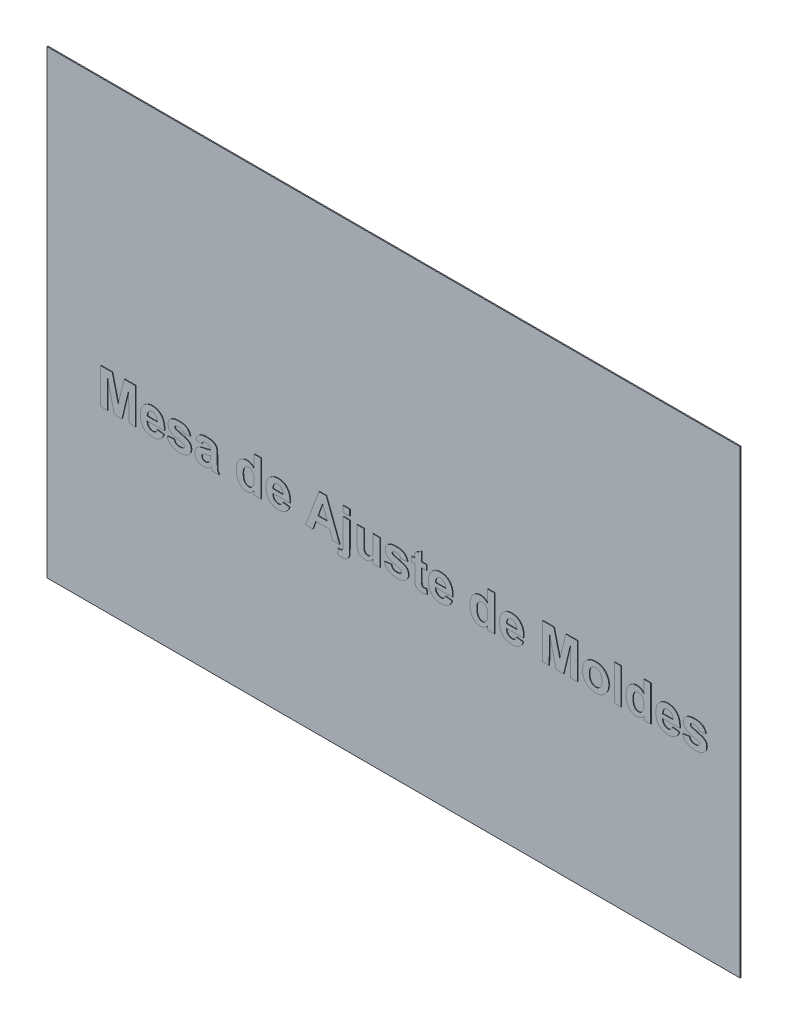
from build123d import *

# Parameters (mm, degrees)
CROQUIS1_W              = 1303
CROQUIS1_H              = 865
SALIENTE_EXTRUIR1_DEPTH = 1.9
CROQUIS2_W              = 12.841593424
CROQUIS2_H              = 11.129380968
CROQUIS2_H_2            = 66.776285808
SALIENTE_EXTRUIR2_DEPTH = 1


with BuildPart() as part:
    # Croquis1 → Saliente-Extruir1 (new body)
    with BuildSketch(Plane.XY):
        with Locations((651.5, -432.5)):
            Rectangle(CROQUIS1_W, CROQUIS1_H)
    extrude(amount=SALIENTE_EXTRUIR1_DEPTH)

    # Croquis2 → Saliente-Extruir2 (add)
    # profile 1 of 21: a face of its own
    with BuildSketch(Plane.XY.offset(1.9)):
        Polygon((101.942581825, -534.66097575), (101.942581825, -467.884689942), (123.666277368, -467.884689942), (134.902671615, -513.43221662), (146.139065861, -467.884689942), (167.862761404, -467.884689942), (167.862761404, -534.66097575), (155.02116798, -534.66097575), (154.593114865, -482.090702668), (142.059184617, -534.66097575), (127.746158612, -534.66097575), (115.212228364, -482.090702668), (114.78417525, -534.66097575), align=None)
    # profile 2 of 21: a face of its own
    with BuildSketch(Plane.XY.offset(1.9)):
        with BuildLine():
            Line((208.099754134, -519.25106364), (220.941347559, -520.963276097))
            add(Edge.make_bspline(
                [(220.941347559, -520.963276097), (220.731305353, -521.541856555), (220.3183176, -522.679469076), (219.563786275, -524.301567506), (218.720368775, -525.815493772), (217.79211985, -527.229336742), (216.782494064, -528.544941069), (215.658106961, -529.734632016), (214.473733439, -530.842697806), (213.179831659, -531.816375947), (211.808822124, -532.692035399), (210.353814886, -533.458228153), (208.803173936, -534.082223858), (207.180380992, -534.604778045), (205.478070003, -535.021881457), (203.689295897, -535.313477743), (201.81635362, -535.490643048), (200.537880496, -535.508157951), (199.886485006, -535.517081978)],
                knots=[0, 0, 0, 0, 1.071172907, 2.106154283, 3.1104349, 4.085737425, 5.048416355, 5.993087888, 6.932482331, 7.868664062, 8.80754521, 9.762367971, 10.726735429, 11.713584758, 12.728370439, 13.774815933, 14.866245336, 16, 16, 16, 16], degree=3))
            add(Edge.make_bspline(
                [(199.886485006, -535.517081978), (198.868570485, -535.491957952), (196.891857943, -535.443169006), (194.032014254, -535.051099429), (191.375827487, -534.412761442), (188.918181895, -533.518644791), (186.667246188, -532.345788153), (184.619630909, -530.919620105), (182.771320398, -529.237041118), (181.735339443, -527.93431097), (181.212667902, -527.277059531)],
                knots=[0, 0, 0, 0, 1.150944905, 2.235047425, 3.25761485, 4.235688044, 5.185329112, 6.119879054, 7.051444229, 8, 8, 8, 8], degree=3))
            add(Edge.make_bspline(
                [(181.212667902, -527.277059531), (180.826936173, -526.717742535), (180.050185078, -525.591441385), (179.084654927, -523.766437408), (178.259045906, -521.838516802), (177.601313782, -519.802157199), (177.054556131, -517.665095749), (176.68669014, -515.413755768), (176.474663381, -513.052861862), (176.440999515, -511.443989671), (176.423823687, -510.623118058)],
                knots=[0, 0, 0, 0, 0.92479112, 1.862259343, 2.806490716, 3.778329015, 4.774107667, 5.808532634, 6.881879269, 8, 8, 8, 8], degree=3))
            add(Edge.make_bspline(
                [(176.423823687, -510.623118058), (176.437949569, -509.650048952), (176.465564151, -507.747803431), (176.792498617, -504.982590087), (177.253821877, -502.367710055), (177.957370946, -499.930329143), (178.836713164, -497.642644065), (179.940321817, -495.534073335), (181.213303807, -493.566262432), (182.701710668, -491.79864148), (184.332822722, -490.209272935), (186.068631913, -488.808772575), (187.922132666, -487.638984222), (189.865717561, -486.662624864), (191.93172638, -485.931798218), (194.09430116, -485.393813856), (196.362897434, -485.066188631), (197.910117241, -485.026813464), (198.695962283, -485.006814508)],
                knots=[0, 0, 0, 0, 1.222152375, 2.389176539, 3.494777592, 4.555389183, 5.572001132, 6.56945427, 7.540785438, 8.511469914, 9.46642023, 10.399267108, 11.30862844, 12.215760073, 13.126777173, 14.056336669, 15.012798191, 16, 16, 16, 16], degree=3))
            add(Edge.make_bspline(
                [(198.695962283, -485.006814508), (199.575482403, -485.025410089), (201.296611091, -485.061799691), (203.806010467, -485.403421806), (206.175315261, -485.959078247), (208.396786139, -486.757524675), (210.484909016, -487.75873776), (212.424153795, -488.99953922), (214.214620019, -490.46859771), (215.851886112, -492.165286843), (217.333639833, -494.078450132), (218.59484325, -496.244990993), (219.650644795, -498.642516392), (220.50659737, -501.277207503), (221.139393113, -504.154580106), (221.572378375, -507.267146096), (221.819302756, -510.614619843), (221.804888628, -512.923500291), (221.797453787, -514.114426271)],
                knots=[0, 0, 0, 0, 0.994942504, 1.946998194, 2.860087576, 3.744358974, 4.613292, 5.475605888, 6.343365869, 7.228414471, 8.138836547, 9.075277299, 10.058013037, 11.098483422, 12.205225682, 13.387753975, 14.652597341, 16, 16, 16, 16], degree=3))
            Line((221.797453787, -514.114426271), (189.265417112, -514.114426271))
            add(Edge.make_bspline(
                [(189.265417112, -514.114426271), (189.286477228, -514.574059781), (189.327488029, -515.469113659), (189.482833384, -516.777440589), (189.751762729, -518.002095039), (190.103704155, -519.150506831), (190.522196784, -520.223481816), (191.054552525, -521.210716748), (191.667894781, -522.12480613), (192.376957086, -522.950843845), (193.153322472, -523.68412244), (193.972562767, -524.328535396), (194.833420488, -524.892023367), (195.758136497, -525.320591927), (196.715966754, -525.682469737), (197.724154099, -525.914428196), (198.775950438, -526.068564116), (199.493526411, -526.089320649), (199.859731687, -526.099913467)],
                knots=[0, 0, 0, 0, 1.231756261, 2.398624542, 3.522625857, 4.583815436, 5.612473245, 6.600564899, 7.580690863, 8.554470542, 9.508734211, 10.435415665, 11.342824763, 12.255949018, 13.158633635, 14.07945191, 15.019874036, 16, 16, 16, 16], degree=3))
            add(Edge.make_bspline(
                [(199.859731687, -526.099913467), (200.3471482, -526.078301205), (201.291201261, -526.036441478), (202.651990245, -525.743151824), (203.88667798, -525.226297415), (205.008202017, -524.505741037), (206.006135043, -523.548841252), (206.842798494, -522.330036013), (207.574317323, -520.887375086), (207.9188458, -519.814447041), (208.099754134, -519.25106364)],
                knots=[0, 0, 0, 0, 1.004430367, 1.945431754, 2.851730883, 3.749038912, 4.678525969, 5.68064125, 6.782128749, 8, 8, 8, 8], degree=3))
        make_face()
        with BuildLine():
            add(Edge.make_bspline(
                [(208.955860362, -506.409470216), (208.933759181, -505.936558927), (208.890715588, -505.015531172), (208.750308836, -503.672674957), (208.509278092, -502.421036601), (208.19225192, -501.253865962), (207.769240397, -500.18553135), (207.296968695, -499.185412735), (206.71778772, -498.284651411), (206.05432684, -497.485316948), (205.354478935, -496.754699485), (204.580859226, -496.147143732), (203.798638549, -495.603427046), (202.967357212, -495.168361902), (202.095627029, -494.835971819), (201.18638369, -494.591590124), (200.238038992, -494.460640098), (199.597016051, -494.436337165), (199.271158655, -494.42398302)],
                knots=[0, 0, 0, 0, 1.317025077, 2.564998298, 3.752245872, 4.859831213, 5.924126069, 6.944952788, 7.932526842, 8.893486968, 9.832088588, 10.740700482, 11.624936399, 12.479435602, 13.343337491, 14.21592381, 15.09308328, 16, 16, 16, 16], degree=3))
            add(Edge.make_bspline(
                [(199.271158655, -494.42398302), (198.922923509, -494.43528684), (198.236708758, -494.457561584), (197.23039527, -494.602900164), (196.276557464, -494.860683483), (195.367926117, -495.209580165), (194.506448459, -495.669040552), (193.692105229, -496.232512048), (192.921832799, -496.892940055), (192.457708357, -497.393286455), (192.221658931, -497.647758036)],
                knots=[0, 0, 0, 0, 1.043516863, 2.056302107, 3.038302912, 3.998520634, 4.966791607, 5.956307719, 6.960596886, 8, 8, 8, 8], degree=3))
            add(Edge.make_bspline(
                [(192.221658931, -497.647758036), (192.00164501, -497.924405437), (191.55960962, -498.480224547), (190.998978414, -499.401794745), (190.510629699, -500.386845359), (190.146703778, -501.461971776), (189.827102981, -502.592331476), (189.63962712, -503.804938646), (189.51333489, -505.082444701), (189.499787669, -505.958773829), (189.492820328, -506.409470216)],
                knots=[0, 0, 0, 0, 0.903873942, 1.815995408, 2.755131859, 3.711650387, 4.716574161, 5.757841734, 6.846857195, 8, 8, 8, 8], degree=3))
            Line((189.492820328, -506.409470216), (208.955860362, -506.409470216))
        make_face(mode=Mode.SUBTRACT)
    # profile 3 of 21: a face of its own
    with BuildSketch(Plane.XY.offset(1.9)):
        with BuildLine():
            Line((226.934091157, -520.107169869), (239.775684581, -518.394957412))
            add(Edge.make_bspline(
                [(239.775684581, -518.394957412), (239.929796256, -518.994745962), (240.226653827, -520.150088499), (240.978578426, -521.720760517), (241.921202449, -523.080934364), (243.108965721, -524.197240327), (244.5342346, -525.076057376), (246.218172344, -525.662227384), (248.136626745, -526.046392132), (249.502863014, -526.081442351), (250.222855898, -526.099913467)],
                knots=[0, 0, 0, 0, 1.039319445, 2.001988807, 2.911187514, 3.807680854, 4.723381073, 5.705509029, 6.790826147, 8, 8, 8, 8], degree=3))
            add(Edge.make_bspline(
                [(250.222855898, -526.099913467), (251.009790879, -526.08602827), (252.489914314, -526.059912002), (254.542180969, -525.697467963), (256.325272118, -525.194001439), (257.304479503, -524.591980296), (257.767292035, -524.307441051)],
                knots=[0, 0, 0, 0, 1.198418162, 2.254070348, 3.174803892, 4, 4, 4, 4], degree=3))
            add(Edge.make_bspline(
                [(257.767292035, -524.307441051), (258.0312778, -524.093135228), (258.544674489, -523.676355557), (259.065665077, -522.837800791), (259.4124513, -521.917389092), (259.447892619, -521.260914443), (259.466127832, -520.923146118)],
                knots=[0, 0, 0, 0, 1.030872991, 2.004830756, 2.973448591, 4, 4, 4, 4], degree=3))
            add(Edge.make_bspline(
                [(259.466127832, -520.923146118), (259.457386675, -520.694566689), (259.440313062, -520.248095301), (259.26165728, -519.60962172), (258.961800211, -519.032557413), (258.683661504, -518.706721691), (258.543138305, -518.54210067)],
                knots=[0, 0, 0, 0, 1.045349703, 2.041822997, 3.010676005, 4, 4, 4, 4], degree=3))
            add(Edge.make_bspline(
                [(258.543138305, -518.54210067), (258.338265056, -518.38720842), (257.862053188, -518.027173481), (256.909374622, -517.6227952), (255.67627961, -517.229432543), (254.746165415, -517.005988493), (254.235853844, -516.883394853)],
                knots=[0, 0, 0, 0, 0.66031085, 1.534841007, 2.647478808, 4, 4, 4, 4], degree=3))
            add(Edge.make_bspline(
                [(254.235853844, -516.883394853), (252.990601882, -516.612295215), (250.61991443, -516.096180782), (247.249443825, -515.275078241), (244.237920244, -514.480287956), (241.577809156, -513.705619823), (239.27831996, -512.957413171), (237.339288269, -512.201285488), (235.74098745, -511.496492639), (234.839828762, -510.947799607), (234.438397314, -510.703378017)],
                knots=[0, 0, 0, 0, 1.469089687, 2.796825535, 3.998745421, 5.059265209, 5.990657066, 6.784841839, 7.458693894, 8, 8, 8, 8], degree=3))
            add(Edge.make_bspline(
                [(234.438397314, -510.703378017), (233.98044301, -510.369557444), (233.08630278, -509.717784108), (231.895313955, -508.595513415), (230.885443752, -507.375299978), (230.059744644, -506.05337082), (229.42951508, -504.632891387), (228.968673706, -503.120454774), (228.701811284, -501.509658617), (228.6650307, -500.404320648), (228.646303613, -499.841530246)],
                knots=[0, 0, 0, 0, 1.056974227, 2.063706289, 3.045111424, 4.005796011, 4.963194591, 5.937303459, 6.949763919, 8, 8, 8, 8], degree=3))
            add(Edge.make_bspline(
                [(228.646303613, -499.841530246), (228.662679872, -499.327992179), (228.695025367, -498.313679795), (228.922475385, -496.826851042), (229.315034992, -495.404402612), (229.868041052, -494.044653755), (230.57694932, -492.747564079), (231.446056639, -491.516168805), (232.467491588, -490.354958576), (233.633690561, -489.247559947), (234.971534894, -488.244603651), (236.484916123, -487.370807188), (238.172126356, -486.633022163), (240.030249987, -486.041954476), (242.056184703, -485.570180969), (244.252633176, -485.24476643), (246.620710546, -485.042050572), (248.256054213, -485.018801455), (249.099216474, -485.006814508)],
                knots=[0, 0, 0, 0, 0.866638136, 1.711736386, 2.531524902, 3.351865931, 4.183724929, 5.020979167, 5.890357771, 6.790086018, 7.73080449, 8.705352504, 9.73310627, 10.832638366, 11.99182341, 13.240303911, 14.577136024, 16, 16, 16, 16], degree=3))
            add(Edge.make_bspline(
                [(249.099216474, -485.006814508), (249.902129484, -485.016346476), (251.460600059, -485.034848221), (253.715314089, -485.197767105), (255.813366135, -485.453346385), (257.744374837, -485.851751663), (259.52916441, -486.312898134), (261.141346987, -486.930168418), (262.613720153, -487.607113588), (263.907424287, -488.44596294), (265.090899861, -489.361826039), (266.158239828, -490.396899449), (267.134993015, -491.529917768), (268.048622405, -492.743039276), (268.809759956, -494.096406278), (269.513828539, -495.529931053), (270.118540579, -497.073600111), (270.434330355, -498.15339109), (270.5955088, -498.704514161)],
                knots=[0, 0, 0, 0, 1.380550213, 2.679676202, 3.885648221, 5.011984379, 6.068504557, 7.051214125, 7.977245523, 8.849391706, 9.696088241, 10.547493682, 11.400830533, 12.26732929, 13.153751704, 14.065965736, 15.012872933, 16, 16, 16, 16], degree=3))
            Line((270.5955088, -498.704514161), (257.753915375, -500.416726618))
            add(Edge.make_bspline(
                [(257.753915375, -500.416726618), (257.626455737, -499.956427996), (257.379022668, -499.062865902), (256.768608645, -497.853159019), (256.007085711, -496.809667244), (255.08189362, -495.938124995), (253.96930931, -495.22910874), (252.632925313, -494.766257387), (251.101419415, -494.464331302), (250.010501117, -494.437939027), (249.433632969, -494.42398302)],
                knots=[0, 0, 0, 0, 1.018425325, 1.977034519, 2.876390575, 3.766006025, 4.677889232, 5.672509542, 6.769243204, 8, 8, 8, 8], degree=3))
            add(Edge.make_bspline(
                [(249.433632969, -494.42398302), (248.718627143, -494.43327614), (247.38976124, -494.450547763), (245.567807067, -494.72569425), (244.032612689, -495.107783595), (243.205874907, -495.592279976), (242.82556302, -495.815155641)],
                knots=[0, 0, 0, 0, 1.252081424, 2.327041614, 3.230413832, 4, 4, 4, 4], degree=3))
            add(Edge.make_bspline(
                [(242.82556302, -495.815155641), (242.619754699, -495.984339131), (242.224820175, -496.308992678), (241.798436394, -496.938139503), (241.527613771, -497.635358128), (241.501286215, -498.131271796), (241.487897038, -498.383474326)],
                knots=[0, 0, 0, 0, 1.057832138, 2.029920023, 2.998093444, 4, 4, 4, 4], degree=3))
            add(Edge.make_bspline(
                [(241.487897038, -498.383474326), (241.50416976, -498.599517924), (241.536624548, -499.030401527), (241.776141943, -499.64897419), (242.176078248, -500.21456073), (242.540869452, -500.514035336), (242.731926401, -500.670883154)],
                knots=[0, 0, 0, 0, 0.958252903, 1.911167308, 2.905987877, 4, 4, 4, 4], degree=3))
            add(Edge.make_bspline(
                [(242.731926401, -500.670883154), (242.912085638, -500.787290189), (243.342513778, -501.065404506), (244.171377409, -501.402612006), (245.247363199, -501.791148232), (246.584199357, -502.211629897), (248.174616579, -502.680932486), (250.026068863, -503.174373384), (252.137797581, -503.690554213), (254.438166169, -504.230965221), (256.777757532, -504.790422813), (258.998602623, -505.399503486), (261.028773853, -506.057581108), (262.869638256, -506.745595729), (264.524916236, -507.472445761), (265.99873847, -508.211204788), (267.286661129, -508.994975114), (268.032551082, -509.590123768), (268.38835993, -509.874025109)],
                knots=[0, 0, 0, 0, 0.374473465, 0.894674728, 1.558250729, 2.377018991, 3.344303564, 4.458456515, 5.727543487, 7.146141891, 8.591136569, 9.934411183, 11.172377707, 12.322386231, 13.369924362, 14.332482298, 15.204550818, 16, 16, 16, 16], degree=3))
            add(Edge.make_bspline(
                [(268.38835993, -509.874025109), (268.704422151, -510.164843659), (269.328937853, -510.739479725), (270.115412623, -511.737235015), (270.812610283, -512.792936925), (271.3524159, -513.951361543), (271.787737694, -515.182156778), (272.096227928, -516.500306725), (272.263466227, -517.904624844), (272.292774482, -518.867185378), (272.307721257, -519.358076919)],
                knots=[0, 0, 0, 0, 0.971012965, 1.9186502, 2.868006896, 3.82989672, 4.803792202, 5.820095146, 6.888280979, 8, 8, 8, 8], degree=3))
            add(Edge.make_bspline(
                [(272.307721257, -519.358076919), (272.287804848, -519.902910829), (272.24856984, -520.976224987), (271.994327343, -522.55966503), (271.541685714, -524.075636288), (270.946091463, -525.547103309), (270.142264679, -526.945472181), (269.17180021, -528.284221989), (268.043792669, -529.579012117), (266.733673499, -530.793870318), (265.246637452, -531.903305333), (263.596770985, -532.886043223), (261.771827828, -533.701433956), (259.782217361, -534.36909704), (257.623756661, -534.884268155), (255.2993258, -535.260107298), (252.808294936, -535.466568882), (251.092699984, -535.499914845), (250.209479239, -535.517081978)],
                knots=[0, 0, 0, 0, 0.853005228, 1.680406763, 2.502135431, 3.325285981, 4.159928718, 5.020072903, 5.910500533, 6.844018396, 7.811498054, 8.809909951, 9.84399402, 10.934451331, 12.090792638, 13.314110396, 14.617253208, 16, 16, 16, 16], degree=3))
            add(Edge.make_bspline(
                [(250.209479239, -535.517081978), (249.402137899, -535.503232024), (247.829799533, -535.476258532), (245.535705582, -535.296338585), (243.374556834, -534.955911582), (241.339901484, -534.505879142), (239.430537502, -533.935566351), (237.653905551, -533.222194649), (236.001667571, -532.382772842), (234.488606307, -531.401457337), (233.105744214, -530.31202747), (231.843295714, -529.131068919), (230.699445132, -527.860191898), (229.698082997, -526.486932178), (228.803483895, -525.032716722), (228.046305505, -523.481802472), (227.406398654, -521.835593395), (227.093369328, -520.690053139), (226.934091157, -520.107169869)],
                knots=[0, 0, 0, 0, 1.275954772, 2.484986887, 3.63311568, 4.730696379, 5.776212371, 6.778566547, 7.752400714, 8.700396387, 9.623767345, 10.531135067, 11.42942751, 12.321590653, 13.213503293, 14.124285009, 15.045583181, 16, 16, 16, 16], degree=3))
        make_face()
    # profile 4 of 21: a face of its own
    with BuildSketch(Plane.XY.offset(1.9)):
        with BuildLine():
            Line((291.998164507, -500.416726618), (280.86878354, -498.704514161))
            add(Edge.make_bspline(
                [(280.86878354, -498.704514161), (281.035573354, -498.140420462), (281.36206102, -497.036218531), (281.961171146, -495.453887181), (282.662723031, -493.991023208), (283.436435272, -492.630150315), (284.306148547, -491.386145494), (285.25796221, -490.255772602), (286.297255518, -489.242900338), (287.428995476, -488.339687306), (288.674955577, -487.53732793), (290.063419335, -486.857086858), (291.592305844, -486.284314204), (293.259468465, -485.824005678), (295.062110147, -485.439169939), (297.014028606, -485.203579321), (299.102634278, -485.033519473), (300.541002762, -485.015890847), (301.281566421, -485.006814508)],
                knots=[0, 0, 0, 0, 1.047140172, 2.049755565, 3.008539736, 3.933190086, 4.833981818, 5.707167246, 6.560530269, 7.413560864, 8.281243119, 9.193714071, 10.161006392, 11.183910126, 12.270717139, 13.439589873, 14.681737877, 16, 16, 16, 16], degree=3))
            add(Edge.make_bspline(
                [(301.281566421, -485.006814508), (301.954979548, -485.010553339), (303.257928123, -485.017787389), (305.145515766, -485.112628865), (306.900152298, -485.26814257), (308.519542008, -485.498019352), (310.009022101, -485.771381106), (311.363835641, -486.118033672), (312.588016109, -486.527122331), (314.002477024, -487.16304258), (315.556179257, -488.056672161), (317.177803218, -489.270065796), (318.478833651, -490.650361187), (319.339868069, -491.938613889), (319.848360499, -493.106270811), (320.207170137, -494.135045283), (320.464977283, -495.337063123), (320.718720415, -496.695114211), (320.874434613, -498.216546583), (321.014962331, -499.901733687), (321.091070394, -501.749254051), (321.100752822, -503.038498087), (321.10577627, -503.707384933)],
                knots=[0, 0, 0, 0, 1.253259065, 2.424859341, 3.516580225, 4.530621704, 5.468151732, 6.333678254, 7.13150538, 7.867126506, 9.216626747, 10.459871386, 11.622324159, 12.731817101, 13.322505456, 13.989117254, 14.756090433, 15.607496751, 16.559714447, 17.600403876, 18.755039204, 20, 20, 20, 20], degree=3))
            Line((321.10577627, -503.707384933), (321.10577627, -518.702620588))
            add(Edge.make_bspline(
                [(321.10577627, -518.702620588), (321.109935953, -519.219835164), (321.117968965, -520.218659012), (321.134435929, -521.664161294), (321.208999404, -523.001510539), (321.287338269, -524.232354609), (321.377591492, -525.361495766), (321.494713351, -526.383721729), (321.641273171, -527.303458203), (321.876408296, -528.401900957), (322.254636301, -529.734609142), (322.873044605, -531.332067955), (323.614875623, -532.995964829), (324.21872995, -534.0943981), (324.530201183, -534.66097575)],
                knots=[0, 0, 0, 0, 1.124218554, 2.171045354, 3.141373911, 4.034856482, 4.851737235, 5.603038048, 6.270604849, 6.87504238, 8.043824301, 9.276776929, 10.59534724, 12, 12, 12, 12], degree=3))
            Line((324.530201183, -534.66097575), (311.688607758, -534.66097575))
            add(Edge.make_bspline(
                [(311.688607758, -534.66097575), (311.596949864, -534.403161782), (311.396108635, -533.838238545), (311.124871828, -532.89127639), (310.799812235, -531.787950664), (310.585497803, -530.991819729), (310.471331715, -530.567717846)],
                knots=[0, 0, 0, 0, 0.768508203, 1.683958961, 2.766236402, 4, 4, 4, 4], degree=3))
            add(Edge.make_bspline(
                [(310.471331715, -530.567717846), (310.422112242, -530.380489643), (310.333020943, -530.041591177), (310.214298286, -529.580654116), (310.111372471, -529.228253403), (310.043747556, -529.029250306), (310.016525281, -528.949142008)],
                knots=[0, 0, 0, 0, 1.381357368, 2.500370598, 3.396327181, 4, 4, 4, 4], degree=3))
            add(Edge.make_bspline(
                [(310.016525281, -528.949142008), (309.473270048, -529.472899272), (308.410210837, -530.497804235), (306.676447896, -531.825159317), (304.905150641, -532.967845068), (303.067544086, -533.90040741), (301.177447126, -534.629249629), (299.216147776, -535.137494273), (297.194130605, -535.453738935), (295.820576613, -535.495855269), (295.128302905, -535.517081978)],
                knots=[0, 0, 0, 0, 1.082260538, 2.117802027, 3.127898709, 4.103827344, 5.070056335, 6.029309159, 7.006768236, 8, 8, 8, 8], degree=3))
            add(Edge.make_bspline(
                [(295.128302905, -535.517081978), (294.525978202, -535.503140168), (293.349548268, -535.475909735), (291.63288335, -535.296031234), (290.019241319, -534.954873187), (288.501231371, -534.501147523), (287.075172367, -533.930725925), (285.75338567, -533.214040928), (284.528117004, -532.367161178), (283.411528073, -531.393187352), (282.410772356, -530.324201485), (281.532496495, -529.186805934), (280.805942168, -527.965747767), (280.204867091, -526.684565493), (279.72929552, -525.332042695), (279.401249949, -523.914332301), (279.192143055, -522.427543265), (279.168604235, -521.41434459), (279.156571083, -520.896392798)],
                knots=[0, 0, 0, 0, 1.186431605, 2.317277787, 3.39378889, 4.430144672, 5.434756152, 6.413230964, 7.385260177, 8.362630794, 9.325691837, 10.265445477, 11.187216893, 12.118354241, 13.048828682, 14.005299944, 14.980300216, 16, 16, 16, 16], degree=3))
            add(Edge.make_bspline(
                [(279.156571083, -520.896392798), (279.178426276, -520.216886592), (279.221310368, -518.883564718), (279.595974686, -516.9465105), (280.182680712, -515.116780209), (281.01657116, -513.417326017), (282.054181406, -511.863362412), (283.302437274, -510.491717497), (284.74334873, -509.323810704), (286.40838122, -508.3319916), (288.361192179, -507.49650364), (290.641813409, -506.691637496), (293.305772391, -505.970288071), (295.215406589, -505.557573794), (296.22518901, -505.339337431)],
                knots=[0, 0, 0, 0, 0.9565892, 1.877012003, 2.769038917, 3.656897043, 4.535078379, 5.39337207, 6.259743944, 7.138913465, 8.11486349, 9.247429708, 10.544487161, 12, 12, 12, 12], degree=3))
            add(Edge.make_bspline(
                [(296.22518901, -505.339337431), (296.921000575, -505.19775012), (298.260413366, -504.925199526), (300.184415803, -504.515409361), (301.942143092, -504.102372478), (303.526135945, -503.682777485), (304.953145061, -503.301547942), (306.208276963, -502.9173896), (307.296484419, -502.530753625), (307.95750051, -502.256281872), (308.264182845, -502.128939074)],
                knots=[0, 0, 0, 0, 1.365613701, 2.628758346, 3.783158308, 4.837685682, 5.780080249, 6.623655076, 7.36143661, 8, 8, 8, 8], degree=3))
            Line((308.264182845, -502.128939074), (308.264182845, -500.911663031))
            add(Edge.make_bspline(
                [(308.264182845, -500.911663031), (308.247071004, -500.365941302), (308.215293341, -499.352505032), (307.899370635, -497.947230405), (307.350962764, -496.789763872), (306.689000969, -496.01831962), (306.034055049, -495.552948524), (305.45574346, -495.243228178), (304.778068496, -494.996048977), (304.010549226, -494.776968619), (303.139994685, -494.627262459), (302.176454309, -494.502952718), (301.117345136, -494.441956597), (300.380922046, -494.430137946), (299.997407078, -494.42398302)],
                knots=[0, 0, 0, 0, 1.600506204, 2.972230995, 4.195852174, 5.327580964, 5.908906329, 6.547275261, 7.247479517, 8.022494018, 8.887774365, 9.837646189, 10.873887764, 12, 12, 12, 12], degree=3))
            add(Edge.make_bspline(
                [(299.997407078, -494.42398302), (299.487790141, -494.436160306), (298.519385892, -494.459300306), (297.154673941, -494.71820715), (295.953842885, -495.124055419), (294.91297567, -495.729977825), (294.015669365, -496.553116682), (293.234332968, -497.614578206), (292.542154977, -498.918984182), (292.186316273, -499.898697535), (291.998164507, -500.416726618)],
                knots=[0, 0, 0, 0, 1.120680009, 2.129582446, 3.045508635, 3.899130849, 4.760899303, 5.707254252, 6.787697471, 8, 8, 8, 8], degree=3))
        make_face()
        with BuildLine():
            add(Edge.make_bspline(
                [(308.264182845, -511.546107586), (307.823444371, -511.682211693), (306.830783902, -511.988754405), (305.163402625, -512.439132559), (303.153615712, -512.913728865), (301.300256196, -513.324390145), (299.753098097, -513.65792749), (298.661683994, -513.930635), (297.67818659, -514.190669523), (296.80113521, -514.463746307), (296.029356035, -514.720801343), (295.374084961, -514.996241938), (294.812514132, -515.237430249), (294.497536501, -515.4393481), (294.352456635, -515.532352211)],
                knots=[0, 0, 0, 0, 1.144223484, 2.577096135, 4.283377528, 6.266557578, 7.286341447, 8.209198618, 9.057088726, 9.80932547, 10.487940513, 11.073343897, 11.57317876, 12, 12, 12, 12], degree=3))
            add(Edge.make_bspline(
                [(294.352456635, -515.532352211), (293.993294511, -515.815230049), (293.304018067, -516.358107532), (292.552626869, -517.407206643), (292.075821915, -518.570288538), (292.024367288, -519.393613117), (291.998164507, -519.812883353)],
                knots=[0, 0, 0, 0, 1.075028234, 2.063111864, 3.013658082, 4, 4, 4, 4], degree=3))
            add(Edge.make_bspline(
                [(291.998164507, -519.812883353), (292.021275453, -520.23004828), (292.066609322, -521.048348841), (292.427695034, -522.227487711), (293.034896796, -523.307760401), (293.861897561, -524.26811385), (294.857029729, -525.099529914), (296.030061753, -525.669388388), (297.322385446, -526.037352971), (298.229009673, -526.078528617), (298.699871076, -526.099913467)],
                knots=[0, 0, 0, 0, 0.976809721, 1.916086158, 2.861451878, 3.862738809, 4.873423621, 5.878632484, 6.898253484, 8, 8, 8, 8], degree=3))
            add(Edge.make_bspline(
                [(298.699871076, -526.099913467), (299.237911317, -526.075568031), (300.321087953, -526.02655607), (301.909709176, -525.578734206), (303.478171982, -524.917755559), (304.430532511, -524.267240326), (304.920017891, -523.932894576)],
                knots=[0, 0, 0, 0, 0.962503947, 1.937702252, 2.940039444, 4, 4, 4, 4], degree=3))
            add(Edge.make_bspline(
                [(304.920017891, -523.932894576), (305.265710534, -523.654589998), (305.937854314, -523.11347148), (306.738955277, -522.124629277), (307.400041147, -521.072736985), (307.663511028, -520.296739054), (307.795999751, -519.906519971)],
                knots=[0, 0, 0, 0, 1.055399509, 2.052054707, 3.020454315, 4, 4, 4, 4], degree=3))
            add(Edge.make_bspline(
                [(307.795999751, -519.906519971), (307.869019252, -519.586513945), (308.039948328, -518.837421792), (308.160542925, -517.518678636), (308.258096388, -515.859445563), (308.262030563, -514.636386012), (308.264182845, -513.967283013)],
                knots=[0, 0, 0, 0, 0.659054705, 1.542760655, 2.655710416, 4, 4, 4, 4], degree=3))
            Line((308.264182845, -513.967283013), (308.264182845, -511.546107586))
        make_face(mode=Mode.SUBTRACT)
    # profile 5 of 21: a face of its own
    with BuildSketch(Plane.XY.offset(1.9)):
        with BuildLine():
            Line((403.291974186, -534.66097575), (390.450380762, -534.66097575))
            Line((390.450380762, -534.66097575), (390.450380762, -527.611476026))
            add(Edge.make_bspline(
                [(390.450380762, -527.611476026), (389.981649738, -528.267860082), (389.070597893, -529.543644859), (387.445506659, -531.17855479), (385.738968531, -532.586592365), (383.879022916, -533.655126809), (381.978702271, -534.48829811), (380.053835778, -535.082258982), (378.112850345, -535.443624179), (376.812128608, -535.492654858), (376.164108077, -535.517081978)],
                knots=[0, 0, 0, 0, 1.136300101, 2.208576455, 3.242281452, 4.249058783, 5.223933999, 6.165280663, 7.085941471, 8, 8, 8, 8], degree=3))
            add(Edge.make_bspline(
                [(376.164108077, -535.517081978), (375.520935764, -535.495492436), (374.249450621, -535.452812145), (372.373416871, -535.143123257), (370.572850328, -534.598464949), (368.83907614, -533.861976713), (367.178461437, -532.914882399), (365.59271133, -531.754578673), (364.078676272, -530.378281903), (362.637925985, -528.811450303), (361.331773173, -527.043662513), (360.173291363, -525.113633858), (359.209311625, -523.007213214), (358.422913656, -520.739588596), (357.80890112, -518.304600281), (357.369695911, -515.706266071), (357.119948398, -512.942176406), (357.081810864, -511.047211767), (357.062237858, -510.074675006)],
                knots=[0, 0, 0, 0, 0.868680302, 1.717291116, 2.559594063, 3.404262612, 4.256691068, 5.136162843, 6.05305749, 7.01654586, 8.006773995, 9.017023416, 10.051895049, 11.130067211, 12.254925639, 13.440213999, 14.686262564, 16, 16, 16, 16], degree=3))
            add(Edge.make_bspline(
                [(357.062237858, -510.074675006), (357.081698242, -509.079854977), (357.119463478, -507.149286071), (357.36789931, -504.344909919), (357.807603178, -501.728576449), (358.421263025, -499.293347835), (359.206240814, -497.03776311), (360.170692764, -494.964920234), (361.309681292, -493.076745142), (362.628289798, -491.390901642), (364.071891926, -489.888704553), (365.627652048, -488.58858957), (367.273446803, -487.482206595), (369.002982765, -486.561873059), (370.838295292, -485.864113351), (372.760041549, -485.377166725), (374.770688854, -485.049565946), (376.144933416, -485.021260823), (376.846317728, -485.006814508)],
                knots=[0, 0, 0, 0, 1.327136196, 2.575468729, 3.751890053, 4.862767969, 5.921925726, 6.933145827, 7.907387355, 8.856890668, 9.782390252, 10.681851331, 11.556239068, 12.423659137, 13.289752485, 14.16837887, 15.06518071, 16, 16, 16, 16], degree=3))
            add(Edge.make_bspline(
                [(376.846317728, -485.006814508), (377.494127459, -485.027654398), (378.770429154, -485.068712729), (380.651501484, -485.387466537), (382.463718802, -485.90423014), (384.20291509, -486.656628445), (385.885771939, -487.593468828), (387.49069034, -488.753076625), (389.033067869, -490.1151827), (389.969677525, -491.150436594), (390.450380762, -491.681767757)],
                knots=[0, 0, 0, 0, 0.992399448, 1.955205421, 2.915485871, 3.87381908, 4.85285833, 5.861755538, 6.90257267, 8, 8, 8, 8], degree=3))
            Line((390.450380762, -491.681767757), (390.450380762, -467.884689942))
            Line((390.450380762, -467.884689942), (403.291974186, -467.884689942))
            Line((403.291974186, -467.884689942), (403.291974186, -534.66097575))
        make_face()
        with BuildLine():
            add(Edge.make_bspline(
                [(369.903831283, -509.338958716), (369.905740968, -509.985728433), (369.909418442, -511.231209871), (370.027482051, -513.028603123), (370.175632143, -514.686228942), (370.409583073, -516.202444319), (370.676271888, -517.58855508), (371.04320712, -518.827696116), (371.445519193, -519.941611492), (371.796043128, -520.60539623), (371.963836894, -520.923146118)],
                knots=[0, 0, 0, 0, 1.306099746, 2.515150209, 3.637201974, 4.666415219, 5.613193253, 6.485405436, 7.274972403, 8, 8, 8, 8], degree=3))
            add(Edge.make_bspline(
                [(371.963836894, -520.923146118), (372.211808841, -521.3363529), (372.691630569, -522.135901379), (373.567076794, -523.181526928), (374.483044083, -524.096107561), (375.506177058, -524.821941263), (376.589349553, -525.407584604), (377.756133162, -525.80627985), (378.989179898, -526.057366667), (379.836975793, -526.085512774), (380.270742641, -526.099913467)],
                knots=[0, 0, 0, 0, 1.120960711, 2.169040953, 3.168100815, 4.128109154, 5.080726846, 6.026866003, 6.990464429, 8, 8, 8, 8], degree=3))
            add(Edge.make_bspline(
                [(380.270742641, -526.099913467), (380.619096036, -526.084839016), (381.306702848, -526.055083903), (382.317224349, -525.885718986), (383.28063148, -525.567509394), (384.202558887, -525.136600973), (385.098800002, -524.600069071), (385.940655327, -523.922186781), (386.745329854, -523.127508949), (387.508649566, -522.218481926), (388.206997532, -521.187425), (388.809105973, -520.028330594), (389.315211215, -518.744251348), (389.741390161, -517.34990641), (390.062199187, -515.832002318), (390.279139397, -514.199550762), (390.437105889, -512.445399829), (390.445863643, -511.234371712), (390.450380762, -510.609741398)],
                knots=[0, 0, 0, 0, 0.808519481, 1.595918141, 2.367946092, 3.154732969, 3.953063559, 4.785064852, 5.655532678, 6.573390792, 7.534530006, 8.538576741, 9.596996712, 10.732480475, 11.917354949, 13.191565377, 14.551451138, 16, 16, 16, 16], degree=3))
            add(Edge.make_bspline(
                [(390.450380762, -510.609741398), (390.444284866, -509.918376908), (390.432513111, -508.583286174), (390.297535984, -506.65408561), (390.076015828, -504.870738474), (389.755670223, -503.240038266), (389.360280735, -501.756055406), (388.865871095, -500.424388807), (388.283729286, -499.238333364), (387.592892679, -498.212569418), (386.833312714, -497.330525141), (386.052052087, -496.541354859), (385.194039238, -495.896970149), (384.296726795, -495.354751243), (383.338667809, -494.935883387), (382.325790686, -494.647219059), (381.268515284, -494.446482227), (380.543687333, -494.431540028), (380.177106022, -494.42398302)],
                knots=[0, 0, 0, 0, 1.538844071, 2.971654591, 4.302575584, 5.536777829, 6.668535022, 7.717613974, 8.694219699, 9.60272161, 10.461894315, 11.283130947, 12.06930595, 12.843865074, 13.612870817, 14.388700961, 15.185086457, 16, 16, 16, 16], degree=3))
            add(Edge.make_bspline(
                [(380.177106022, -494.42398302), (379.819681189, -494.433058677), (379.113801713, -494.450982222), (378.080087043, -494.629442277), (377.091364188, -494.925221107), (376.152073786, -495.346532157), (375.247250541, -495.870628595), (374.388055624, -496.515381706), (373.582253375, -497.288711497), (372.824042379, -498.169556383), (372.117206283, -499.156997529), (371.538877862, -500.281868509), (371.022926838, -501.504200967), (370.612885403, -502.849607293), (370.293874007, -504.308283259), (370.074550923, -505.882676143), (369.917097236, -507.570066373), (369.908348656, -508.736608726), (369.903831283, -509.338958716)],
                knots=[0, 0, 0, 0, 0.844531552, 1.667868134, 2.47173451, 3.278912967, 4.096287191, 4.939765054, 5.812329042, 6.731790039, 7.685377109, 8.6758465, 9.71559549, 10.819442259, 11.996209133, 13.242749135, 14.576279701, 16, 16, 16, 16], degree=3))
        make_face(mode=Mode.SUBTRACT)
    # profile 6 of 21: a face of its own
    with BuildSketch(Plane.XY.offset(1.9)):
        with BuildLine():
            Line((444.385073145, -519.25106364), (457.226666569, -520.963276097))
            add(Edge.make_bspline(
                [(457.226666569, -520.963276097), (457.016624363, -521.541856555), (456.60363661, -522.679469076), (455.849105285, -524.301567506), (455.005687785, -525.815493772), (454.077438861, -527.229336742), (453.067813074, -528.544941069), (451.943425971, -529.734632016), (450.759052449, -530.842697806), (449.465150669, -531.816375947), (448.094141135, -532.692035399), (446.639133896, -533.458228153), (445.088492947, -534.082223858), (443.465700003, -534.604778045), (441.763389014, -535.021881457), (439.974614907, -535.313477743), (438.10167263, -535.490643048), (436.823199507, -535.508157951), (436.171804017, -535.517081978)],
                knots=[0, 0, 0, 0, 1.071172907, 2.106154283, 3.1104349, 4.085737425, 5.048416355, 5.993087888, 6.932482331, 7.868664062, 8.80754521, 9.762367971, 10.726735429, 11.713584758, 12.728370439, 13.774815933, 14.866245336, 16, 16, 16, 16], degree=3))
            add(Edge.make_bspline(
                [(436.171804017, -535.517081978), (435.153889496, -535.491957952), (433.177176953, -535.443169006), (430.317333264, -535.051099429), (427.661146498, -534.412761442), (425.203500905, -533.518644791), (422.952565198, -532.345788153), (420.90494992, -530.919620105), (419.056639408, -529.237041118), (418.020658453, -527.93431097), (417.497986912, -527.277059531)],
                knots=[0, 0, 0, 0, 1.150944905, 2.235047425, 3.25761485, 4.235688044, 5.185329112, 6.119879054, 7.051444229, 8, 8, 8, 8], degree=3))
            add(Edge.make_bspline(
                [(417.497986912, -527.277059531), (417.112255184, -526.717742535), (416.335504089, -525.591441385), (415.369973938, -523.766437408), (414.544364917, -521.838516802), (413.886632793, -519.802157199), (413.339875141, -517.665095749), (412.972009151, -515.413755768), (412.759982391, -513.052861862), (412.726318525, -511.443989671), (412.709142698, -510.623118058)],
                knots=[0, 0, 0, 0, 0.92479112, 1.862259343, 2.806490716, 3.778329015, 4.774107667, 5.808532634, 6.881879269, 8, 8, 8, 8], degree=3))
            add(Edge.make_bspline(
                [(412.709142698, -510.623118058), (412.72326858, -509.650048952), (412.750883162, -507.747803431), (413.077817627, -504.982590087), (413.539140888, -502.367710055), (414.242689957, -499.930329143), (415.122032174, -497.642644065), (416.225640828, -495.534073335), (417.498622817, -493.566262432), (418.987029678, -491.79864148), (420.618141733, -490.209272935), (422.353950924, -488.808772575), (424.207451677, -487.638984222), (426.151036571, -486.662624864), (428.21704539, -485.931798218), (430.37962017, -485.393813856), (432.648216444, -485.066188631), (434.195436251, -485.026813464), (434.981281293, -485.006814508)],
                knots=[0, 0, 0, 0, 1.222152375, 2.389176539, 3.494777592, 4.555389183, 5.572001132, 6.56945427, 7.540785438, 8.511469914, 9.46642023, 10.399267108, 11.30862844, 12.215760073, 13.126777173, 14.056336669, 15.012798191, 16, 16, 16, 16], degree=3))
            add(Edge.make_bspline(
                [(434.981281293, -485.006814508), (435.860801413, -485.025410089), (437.581930101, -485.061799691), (440.091329477, -485.403421806), (442.460634272, -485.959078247), (444.68210515, -486.757524675), (446.770228027, -487.75873776), (448.709472805, -488.99953922), (450.499939029, -490.46859771), (452.137205122, -492.165286843), (453.618958843, -494.078450132), (454.88016226, -496.244990993), (455.935963805, -498.642516392), (456.79191638, -501.277207503), (457.424712124, -504.154580106), (457.857697386, -507.267146096), (458.104621767, -510.614619843), (458.090207639, -512.923500291), (458.082772797, -514.114426271)],
                knots=[0, 0, 0, 0, 0.994942504, 1.946998194, 2.860087576, 3.744358974, 4.613292, 5.475605888, 6.343365869, 7.228414471, 8.138836547, 9.075277299, 10.058013037, 11.098483422, 12.205225682, 13.387753975, 14.652597341, 16, 16, 16, 16], degree=3))
            Line((458.082772797, -514.114426271), (425.550736122, -514.114426271))
            add(Edge.make_bspline(
                [(425.550736122, -514.114426271), (425.571796238, -514.574059781), (425.61280704, -515.469113659), (425.768152394, -516.777440589), (426.037081739, -518.002095039), (426.389023166, -519.150506831), (426.807515794, -520.223481816), (427.339871535, -521.210716748), (427.953213791, -522.12480613), (428.662276097, -522.950843845), (429.438641482, -523.68412244), (430.257881778, -524.328535396), (431.118739498, -524.892023367), (432.043455507, -525.320591927), (433.001285764, -525.682469737), (434.00947311, -525.914428196), (435.061269449, -526.068564116), (435.778845422, -526.089320649), (436.145050697, -526.099913467)],
                knots=[0, 0, 0, 0, 1.231756261, 2.398624542, 3.522625857, 4.583815436, 5.612473245, 6.600564899, 7.580690863, 8.554470542, 9.508734211, 10.435415665, 11.342824763, 12.255949018, 13.158633635, 14.07945191, 15.019874036, 16, 16, 16, 16], degree=3))
            add(Edge.make_bspline(
                [(436.145050697, -526.099913467), (436.632467211, -526.078301205), (437.576520271, -526.036441478), (438.937309255, -525.743151824), (440.17199699, -525.226297415), (441.293521027, -524.505741037), (442.291454053, -523.548841252), (443.128117505, -522.330036013), (443.859636334, -520.887375086), (444.204164811, -519.814447041), (444.385073145, -519.25106364)],
                knots=[0, 0, 0, 0, 1.004430367, 1.945431754, 2.851730883, 3.749038912, 4.678525969, 5.68064125, 6.782128749, 8, 8, 8, 8], degree=3))
        make_face()
        with BuildLine():
            add(Edge.make_bspline(
                [(445.241179373, -506.409470216), (445.219078192, -505.936558927), (445.176034598, -505.015531172), (445.035627847, -503.672674957), (444.794597102, -502.421036601), (444.47757093, -501.253865962), (444.054559407, -500.18553135), (443.582287705, -499.185412735), (443.00310673, -498.284651411), (442.339645851, -497.485316948), (441.639797945, -496.754699485), (440.866178236, -496.147143732), (440.083957559, -495.603427046), (439.252676222, -495.168361902), (438.38094604, -494.835971819), (437.4717027, -494.591590124), (436.523358002, -494.460640098), (435.882335062, -494.436337165), (435.556477665, -494.42398302)],
                knots=[0, 0, 0, 0, 1.317025077, 2.564998298, 3.752245872, 4.859831213, 5.924126069, 6.944952788, 7.932526842, 8.893486968, 9.832088588, 10.740700482, 11.624936399, 12.479435602, 13.343337491, 14.21592381, 15.09308328, 16, 16, 16, 16], degree=3))
            add(Edge.make_bspline(
                [(435.556477665, -494.42398302), (435.208242519, -494.43528684), (434.522027769, -494.457561584), (433.51571428, -494.602900164), (432.561876474, -494.860683483), (431.653245127, -495.209580165), (430.791767469, -495.669040552), (429.977424239, -496.232512048), (429.20715181, -496.892940055), (428.743027368, -497.393286455), (428.506977942, -497.647758036)],
                knots=[0, 0, 0, 0, 1.043516863, 2.056302107, 3.038302912, 3.998520634, 4.966791607, 5.956307719, 6.960596886, 8, 8, 8, 8], degree=3))
            add(Edge.make_bspline(
                [(428.506977942, -497.647758036), (428.28696402, -497.924405437), (427.844928631, -498.480224547), (427.284297424, -499.401794745), (426.79594871, -500.386845359), (426.432022788, -501.461971776), (426.112421992, -502.592331476), (425.924946131, -503.804938646), (425.7986539, -505.082444701), (425.785106679, -505.958773829), (425.778139339, -506.409470216)],
                knots=[0, 0, 0, 0, 0.903873942, 1.815995408, 2.755131859, 3.711650387, 4.716574161, 5.757841734, 6.846857195, 8, 8, 8, 8], degree=3))
            Line((425.778139339, -506.409470216), (445.241179373, -506.409470216))
        make_face(mode=Mode.SUBTRACT)
    # profile 7 of 21: a face of its own
    with BuildSketch(Plane.XY.offset(1.9)):
        Polygon((551.398351682, -534.66097575), (537.780911988, -534.66097575), (532.149338205, -519.25106364), (506.519657995, -519.25106364), (500.888084212, -534.66097575), (487.190384559, -534.66097575), (512.432141634, -467.884689942), (526.036204669, -467.884689942), align=None)
        Polygon((528.069456961, -508.121682672), (519.294368121, -484.15070828), (510.5460326, -508.121682672), align=None, mode=Mode.SUBTRACT)
    # profile 8 of 21: a face of its own
    with BuildSketch(Plane.XY.offset(1.9)):
        with Locations((563.811891992, -473.449380426)):
            Rectangle(CROQUIS2_W, CROQUIS2_H)
    # profile 9 of 21: a face of its own
    with BuildSketch(Plane.XY.offset(1.9)):
        with BuildLine():
            Line((570.232688704, -485.862920737), (570.232688704, -532.4805802))
            add(Edge.make_bspline(
                [(570.232688704, -532.4805802), (570.232846359, -533.216366571), (570.233150278, -534.634779268), (570.159438582, -536.67713833), (570.065599381, -538.554393555), (569.958193548, -540.264753102), (569.777416214, -541.802520205), (569.583537454, -543.174021383), (569.348523812, -544.377131128), (568.980207147, -545.738142835), (568.384263689, -547.257619719), (567.359507174, -548.865861209), (566.056703114, -550.260544921), (564.481968963, -551.429419326), (562.663371277, -552.378856206), (560.586620874, -553.016356157), (558.294734097, -553.428629108), (556.688544143, -553.472490131), (555.852779401, -553.495312772)],
                knots=[0, 0, 0, 0, 1.189367398, 2.292803839, 3.303206162, 4.22812788, 5.062345304, 5.805484748, 6.467066151, 7.042365425, 8.083738016, 9.09156593, 10.106483352, 11.151665809, 12.24780317, 13.405828641, 14.650149099, 16, 16, 16, 16], degree=3))
            add(Edge.make_bspline(
                [(555.852779401, -553.495312772), (555.201118658, -553.478617228), (553.844703773, -553.443865886), (551.740671939, -553.185538792), (549.476924679, -552.782041514), (547.927489226, -552.407088063), (547.11782054, -552.21115343)],
                knots=[0, 0, 0, 0, 0.883463593, 1.838906488, 2.870704978, 4, 4, 4, 4], degree=3))
            Line((547.11782054, -552.21115343), (548.401979883, -541.95125535))
            add(Edge.make_bspline(
                [(548.401979883, -541.95125535), (548.713787643, -542.010954204), (549.313612872, -542.125797013), (550.19131268, -542.264874941), (551.008814825, -542.347683779), (551.53641674, -542.360067301), (551.786274817, -542.365931804)],
                knots=[0, 0, 0, 0, 1.115558763, 2.146002687, 3.121996735, 4, 4, 4, 4], degree=3))
            add(Edge.make_bspline(
                [(551.786274817, -542.365931804), (552.117113398, -542.357119579), (552.751817928, -542.340213571), (553.653454789, -542.172087594), (554.473272169, -541.929308142), (555.184169778, -541.545310666), (555.789656833, -541.095940044), (556.302638343, -540.6078244), (556.696029283, -540.070243629), (556.934103715, -539.557725711), (557.078221234, -539.059340422), (557.142317445, -538.531698302), (557.228018849, -537.864195248), (557.294896838, -537.043063992), (557.322833746, -536.074405574), (557.374672228, -534.955722013), (557.375653123, -533.688875589), (557.385763478, -532.792678956), (557.39109528, -532.320060282)],
                knots=[0, 0, 0, 0, 1.17634618, 2.25678712, 3.255802797, 4.207280227, 5.115260744, 5.934703252, 6.718951887, 7.471725886, 7.933966188, 8.560312015, 9.35967587, 10.331200396, 11.490936472, 12.80928876, 14.31734503, 16, 16, 16, 16], degree=3))
            Line((557.39109528, -532.320060282), (557.39109528, -485.862920737))
            Line((557.39109528, -485.862920737), (570.232688704, -485.862920737))
        make_face()
    # profile 10 of 21: a face of its own
    with BuildSketch(Plane.XY.offset(1.9)):
        with BuildLine():
            Line((613.894106348, -534.66097575), (613.894106348, -527.477709428))
            add(Edge.make_bspline(
                [(613.894106348, -527.477709428), (613.468936503, -528.092526217), (612.625240322, -529.312552951), (611.074771702, -530.911291588), (609.338507857, -532.298526779), (607.428549758, -533.454675547), (605.40354358, -534.376799511), (603.297399891, -535.03888157), (601.13444136, -535.43660551), (599.671875293, -535.490217594), (598.939000672, -535.517081978)],
                knots=[0, 0, 0, 0, 1.012300957, 2.008784164, 3.006972158, 4.019128624, 5.028517728, 6.017265291, 7.006475003, 8, 8, 8, 8], degree=3))
            add(Edge.make_bspline(
                [(598.939000672, -535.517081978), (598.196955257, -535.49251826), (596.741691086, -535.444345065), (594.62128888, -535.031366563), (592.619721108, -534.356376668), (590.746945948, -533.428222801), (589.065562735, -532.240252751), (587.601796072, -530.833668838), (586.418890005, -529.186598133), (585.633191534, -527.655116267), (585.140141612, -526.308641022), (584.824920473, -525.193226845), (584.539153049, -523.9851458), (584.319886035, -522.684317143), (584.142002022, -521.292202547), (584.030236154, -519.809760336), (583.943442549, -518.230987367), (583.934820872, -517.146603776), (583.930388357, -516.589108337)],
                knots=[0, 0, 0, 0, 1.289498181, 2.528902495, 3.740215999, 4.953909685, 6.150063847, 7.307074614, 8.467199117, 9.660131987, 10.288158488, 10.958106275, 11.674712228, 12.445953132, 13.25095176, 14.114470792, 15.030625377, 16, 16, 16, 16], degree=3))
            Line((583.930388357, -516.589108337), (583.930388357, -485.862920737))
            Line((583.930388357, -485.862920737), (596.771981782, -485.862920737))
            Line((596.771981782, -485.862920737), (596.771981782, -508.375839209))
            add(Edge.make_bspline(
                [(596.771981782, -508.375839209), (596.775747063, -509.196271878), (596.782889017, -510.752461805), (596.803680905, -512.964376857), (596.860733519, -514.921783454), (596.921680248, -516.6302121), (597.01205065, -518.089079326), (597.129228438, -519.298328246), (597.260032556, -520.258082935), (597.438871755, -521.193723545), (597.806062218, -522.132785184), (598.311836739, -523.141512557), (599.003248825, -524.007393815), (599.803080312, -524.759432858), (600.735124138, -525.382599647), (601.810239716, -525.776094003), (602.981010471, -526.069809367), (603.806010655, -526.089596594), (604.23615796, -526.099913467)],
                knots=[0, 0, 0, 0, 1.799930418, 3.414093185, 4.852592097, 6.095879458, 7.164323302, 8.058836106, 8.760219181, 9.289718358, 10.143846288, 10.96209893, 11.756558504, 12.559405005, 13.365225682, 14.195378484, 15.059087384, 16, 16, 16, 16], degree=3))
            add(Edge.make_bspline(
                [(604.23615796, -526.099913467), (604.7328225, -526.075161324), (605.710858406, -526.026419202), (607.140267019, -525.686742272), (608.475206754, -525.096830457), (609.719990611, -524.312129963), (610.809799454, -523.340589284), (611.756144685, -522.261492373), (612.493314386, -521.06231536), (612.963364325, -519.944683318), (613.24504222, -518.886156555), (613.399591816, -517.835540867), (613.569161561, -516.5527233), (613.672847232, -515.02016733), (613.789441448, -513.246367591), (613.845737248, -511.225337786), (613.888102339, -508.96015184), (613.892035332, -507.368162029), (613.894106348, -506.529860154)],
                knots=[0, 0, 0, 0, 0.960139447, 1.890714513, 2.821289579, 3.770841791, 4.723832156, 5.63466777, 6.536687779, 7.433335375, 7.968708987, 8.650470788, 9.484586637, 10.470508532, 11.619255361, 12.921832212, 14.379114108, 16, 16, 16, 16], degree=3))
            Line((613.894106348, -506.529860154), (613.894106348, -485.862920737))
            Line((613.894106348, -485.862920737), (626.735699772, -485.862920737))
            Line((626.735699772, -485.862920737), (626.735699772, -534.66097575))
            Line((626.735699772, -534.66097575), (613.894106348, -534.66097575))
        make_face()
    # profile 11 of 21: a face of its own
    with BuildSketch(Plane.XY.offset(1.9)):
        with BuildLine():
            Line((635.296762055, -520.107169869), (648.13835548, -518.394957412))
            add(Edge.make_bspline(
                [(648.13835548, -518.394957412), (648.292467154, -518.994745962), (648.589324726, -520.150088499), (649.341249324, -521.720760517), (650.283873347, -523.080934364), (651.47163662, -524.197240327), (652.896905498, -525.076057376), (654.580843242, -525.662227384), (656.499297644, -526.046392132), (657.865533912, -526.081442351), (658.585526797, -526.099913467)],
                knots=[0, 0, 0, 0, 1.039319445, 2.001988807, 2.911187514, 3.807680854, 4.723381073, 5.705509029, 6.790826147, 8, 8, 8, 8], degree=3))
            add(Edge.make_bspline(
                [(658.585526797, -526.099913467), (659.372461778, -526.08602827), (660.852585212, -526.059912002), (662.904851868, -525.697467963), (664.687943017, -525.194001439), (665.667150402, -524.591980296), (666.129962934, -524.307441051)],
                knots=[0, 0, 0, 0, 1.198418162, 2.254070348, 3.174803892, 4, 4, 4, 4], degree=3))
            add(Edge.make_bspline(
                [(666.129962934, -524.307441051), (666.393948699, -524.093135228), (666.907345388, -523.676355557), (667.428335975, -522.837800791), (667.775122199, -521.917389092), (667.810563518, -521.260914443), (667.82879873, -520.923146118)],
                knots=[0, 0, 0, 0, 1.030872991, 2.004830756, 2.973448591, 4, 4, 4, 4], degree=3))
            add(Edge.make_bspline(
                [(667.82879873, -520.923146118), (667.820057573, -520.694566689), (667.80298396, -520.248095301), (667.624328179, -519.60962172), (667.32447111, -519.032557413), (667.046332402, -518.706721691), (666.905809203, -518.54210067)],
                knots=[0, 0, 0, 0, 1.045349703, 2.041822997, 3.010676005, 4, 4, 4, 4], degree=3))
            add(Edge.make_bspline(
                [(666.905809203, -518.54210067), (666.700935954, -518.38720842), (666.224724086, -518.027173481), (665.272045521, -517.6227952), (664.038950508, -517.229432543), (663.108836313, -517.005988493), (662.598524742, -516.883394853)],
                knots=[0, 0, 0, 0, 0.66031085, 1.534841007, 2.647478808, 4, 4, 4, 4], degree=3))
            add(Edge.make_bspline(
                [(662.598524742, -516.883394853), (661.35327278, -516.612295215), (658.982585329, -516.096180782), (655.612114723, -515.275078241), (652.600591142, -514.480287956), (649.940480055, -513.705619823), (647.640990859, -512.957413171), (645.701959167, -512.201285488), (644.103658348, -511.496492639), (643.202499661, -510.947799607), (642.801068213, -510.703378017)],
                knots=[0, 0, 0, 0, 1.469089687, 2.796825535, 3.998745421, 5.059265209, 5.990657066, 6.784841839, 7.458693894, 8, 8, 8, 8], degree=3))
            add(Edge.make_bspline(
                [(642.801068213, -510.703378017), (642.343113908, -510.369557444), (641.448973678, -509.717784108), (640.257984854, -508.595513415), (639.248114651, -507.375299978), (638.422415543, -506.05337082), (637.792185978, -504.632891387), (637.331344605, -503.120454774), (637.064482183, -501.509658617), (637.027701598, -500.404320648), (637.008974512, -499.841530246)],
                knots=[0, 0, 0, 0, 1.056974227, 2.063706289, 3.045111424, 4.005796011, 4.963194591, 5.937303459, 6.949763919, 8, 8, 8, 8], degree=3))
            add(Edge.make_bspline(
                [(637.008974512, -499.841530246), (637.025350771, -499.327992179), (637.057696265, -498.313679795), (637.285146283, -496.826851042), (637.677705891, -495.404402612), (638.23071195, -494.044653755), (638.939620218, -492.747564079), (639.808727538, -491.516168805), (640.830162487, -490.354958576), (641.99636146, -489.247559947), (643.334205792, -488.244603651), (644.847587021, -487.370807188), (646.534797254, -486.633022163), (648.392920886, -486.041954476), (650.418855601, -485.570180969), (652.615304075, -485.24476643), (654.983381444, -485.042050572), (656.618725111, -485.018801455), (657.461887372, -485.006814508)],
                knots=[0, 0, 0, 0, 0.866638136, 1.711736386, 2.531524902, 3.351865931, 4.183724929, 5.020979167, 5.890357771, 6.790086018, 7.73080449, 8.705352504, 9.73310627, 10.832638366, 11.99182341, 13.240303911, 14.577136024, 16, 16, 16, 16], degree=3))
            add(Edge.make_bspline(
                [(657.461887372, -485.006814508), (658.264800382, -485.016346476), (659.823270958, -485.034848221), (662.077984987, -485.197767105), (664.176037033, -485.453346385), (666.107045736, -485.851751663), (667.891835309, -486.312898134), (669.504017886, -486.930168418), (670.976391052, -487.607113588), (672.270095186, -488.44596294), (673.45357076, -489.361826039), (674.520910726, -490.396899449), (675.497663914, -491.529917768), (676.411293303, -492.743039276), (677.172430855, -494.096406278), (677.876499437, -495.529931053), (678.481211477, -497.073600111), (678.797001253, -498.15339109), (678.958179698, -498.704514161)],
                knots=[0, 0, 0, 0, 1.380550213, 2.679676202, 3.885648221, 5.011984379, 6.068504557, 7.051214125, 7.977245523, 8.849391706, 9.696088241, 10.547493682, 11.400830533, 12.26732929, 13.153751704, 14.065965736, 15.012872933, 16, 16, 16, 16], degree=3))
            Line((678.958179698, -498.704514161), (666.116586274, -500.416726618))
            add(Edge.make_bspline(
                [(666.116586274, -500.416726618), (665.989126636, -499.956427996), (665.741693566, -499.062865902), (665.131279543, -497.853159019), (664.369756609, -496.809667244), (663.444564518, -495.938124995), (662.331980208, -495.22910874), (660.995596211, -494.766257387), (659.464090313, -494.464331302), (658.373172015, -494.437939027), (657.796303868, -494.42398302)],
                knots=[0, 0, 0, 0, 1.018425325, 1.977034519, 2.876390575, 3.766006025, 4.677889232, 5.672509542, 6.769243204, 8, 8, 8, 8], degree=3))
            add(Edge.make_bspline(
                [(657.796303868, -494.42398302), (657.081298041, -494.43327614), (655.752432139, -494.450547763), (653.930477965, -494.72569425), (652.395283587, -495.107783595), (651.568545805, -495.592279976), (651.188233918, -495.815155641)],
                knots=[0, 0, 0, 0, 1.252081424, 2.327041614, 3.230413832, 4, 4, 4, 4], degree=3))
            add(Edge.make_bspline(
                [(651.188233918, -495.815155641), (650.982425597, -495.984339131), (650.587491073, -496.308992678), (650.161107292, -496.938139503), (649.890284669, -497.635358128), (649.863957114, -498.131271796), (649.850567936, -498.383474326)],
                knots=[0, 0, 0, 0, 1.057832138, 2.029920023, 2.998093444, 4, 4, 4, 4], degree=3))
            add(Edge.make_bspline(
                [(649.850567936, -498.383474326), (649.866840659, -498.599517924), (649.899295447, -499.030401527), (650.138812842, -499.64897419), (650.538749146, -500.21456073), (650.903540351, -500.514035336), (651.094597299, -500.670883154)],
                knots=[0, 0, 0, 0, 0.958252903, 1.911167308, 2.905987877, 4, 4, 4, 4], degree=3))
            add(Edge.make_bspline(
                [(651.094597299, -500.670883154), (651.274756537, -500.787290189), (651.705184676, -501.065404506), (652.534048307, -501.402612006), (653.610034097, -501.791148232), (654.946870255, -502.211629897), (656.537287478, -502.680932486), (658.388739761, -503.174373384), (660.50046848, -503.690554213), (662.800837067, -504.230965221), (665.14042843, -504.790422813), (667.361273522, -505.399503486), (669.391444751, -506.057581108), (671.232309154, -506.745595729), (672.887587135, -507.472445761), (674.361409369, -508.211204788), (675.649332027, -508.994975114), (676.39522198, -509.590123768), (676.751030829, -509.874025109)],
                knots=[0, 0, 0, 0, 0.374473465, 0.894674728, 1.558250729, 2.377018991, 3.344303564, 4.458456515, 5.727543487, 7.146141891, 8.591136569, 9.934411183, 11.172377707, 12.322386231, 13.369924362, 14.332482298, 15.204550818, 16, 16, 16, 16], degree=3))
            add(Edge.make_bspline(
                [(676.751030829, -509.874025109), (677.06709305, -510.164843659), (677.691608752, -510.739479725), (678.478083521, -511.737235015), (679.175281182, -512.792936925), (679.715086798, -513.951361543), (680.150408593, -515.182156778), (680.458898826, -516.500306725), (680.626137125, -517.904624844), (680.655445381, -518.867185378), (680.670392155, -519.358076919)],
                knots=[0, 0, 0, 0, 0.971012965, 1.9186502, 2.868006896, 3.82989672, 4.803792202, 5.820095146, 6.888280979, 8, 8, 8, 8], degree=3))
            add(Edge.make_bspline(
                [(680.670392155, -519.358076919), (680.650475747, -519.902910829), (680.611240739, -520.976224987), (680.356998242, -522.55966503), (679.904356612, -524.075636288), (679.308762362, -525.547103309), (678.504935577, -526.945472181), (677.534471108, -528.284221989), (676.406463568, -529.579012117), (675.096344398, -530.793870318), (673.609308351, -531.903305333), (671.959441883, -532.886043223), (670.134498727, -533.701433956), (668.14488826, -534.36909704), (665.986427559, -534.884268155), (663.661996699, -535.260107298), (661.170965835, -535.466568882), (659.455370882, -535.499914845), (658.572150137, -535.517081978)],
                knots=[0, 0, 0, 0, 0.853005228, 1.680406763, 2.502135431, 3.325285981, 4.159928718, 5.020072903, 5.910500533, 6.844018396, 7.811498054, 8.809909951, 9.84399402, 10.934451331, 12.090792638, 13.314110396, 14.617253208, 16, 16, 16, 16], degree=3))
            add(Edge.make_bspline(
                [(658.572150137, -535.517081978), (657.764808798, -535.503232024), (656.192470432, -535.476258532), (653.89837648, -535.296338585), (651.737227732, -534.955911582), (649.702572382, -534.505879142), (647.7932084, -533.935566351), (646.016576449, -533.222194649), (644.364338469, -532.382772842), (642.851277206, -531.401457337), (641.468415112, -530.31202747), (640.205966613, -529.131068919), (639.06211603, -527.860191898), (638.060753896, -526.486932178), (637.166154793, -525.032716722), (636.408976404, -523.481802472), (635.769069552, -521.835593395), (635.456040226, -520.690053139), (635.296762055, -520.107169869)],
                knots=[0, 0, 0, 0, 1.275954772, 2.484986887, 3.63311568, 4.730696379, 5.776212371, 6.778566547, 7.752400714, 8.700396387, 9.623767345, 10.531135067, 11.42942751, 12.321590653, 13.213503293, 14.124285009, 15.045583181, 16, 16, 16, 16], degree=3))
        make_face()
    # profile 12 of 21: a face of its own
    with BuildSketch(Plane.XY.offset(1.9)):
        with BuildLine():
            Line((714.914641287, -485.862920737), (714.914641287, -495.280089248))
            Line((714.914641287, -495.280089248), (705.497472776, -495.280089248))
            Line((705.497472776, -495.280089248), (705.497472776, -516.254691841))
            add(Edge.make_bspline(
                [(705.497472776, -516.254691841), (705.496495606, -516.758547044), (705.494653641, -517.7083141), (705.506771273, -519.050549987), (705.535251859, -520.227644398), (705.564826487, -521.239654292), (705.579702142, -522.087945734), (705.637517478, -522.765476047), (705.690038771, -523.278141641), (705.771548928, -523.909514552), (706.145948793, -524.673322748), (706.767767838, -525.340885612), (707.406973839, -525.728390321), (707.949569526, -525.942155482), (708.540380959, -526.081705325), (708.952306763, -526.093758104), (709.162677566, -526.099913467)],
                knots=[0, 0, 0, 0, 1.772607892, 3.341365874, 4.72216035, 5.914769548, 6.903535532, 7.706019004, 8.305410619, 8.718065781, 9.939723765, 11.215765275, 11.877591902, 12.553399735, 13.261220211, 14, 14, 14, 14], degree=3))
            add(Edge.make_bspline(
                [(709.162677566, -526.099913467), (709.506849051, -526.080448323), (710.267936117, -526.037403881), (711.502789749, -525.790097583), (712.933986753, -525.396519335), (713.944377415, -525.053393836), (714.486588173, -524.869260764)],
                knots=[0, 0, 0, 0, 0.753421026, 1.666085143, 2.747540144, 4, 4, 4, 4], degree=3))
            Line((714.486588173, -524.869260764), (715.770747515, -533.818246181))
            add(Edge.make_bspline(
                [(715.770747515, -533.818246181), (714.990928217, -534.08577319), (713.404566305, -534.629994985), (710.877757498, -535.125120532), (708.213205254, -535.461420415), (706.38148554, -535.498237887), (705.443966136, -535.517081978)],
                knots=[0, 0, 0, 0, 0.939547081, 1.911291127, 2.930947196, 4, 4, 4, 4], degree=3))
            add(Edge.make_bspline(
                [(705.443966136, -535.517081978), (704.86817843, -535.499973233), (703.743777387, -535.466563193), (702.097285265, -535.254795909), (700.542140341, -534.879311514), (699.089518385, -534.361783013), (697.77765755, -533.725820178), (696.622238364, -533.011967062), (695.674466796, -532.181478819), (694.882781126, -531.264838126), (694.258335768, -530.200500467), (693.762592073, -528.989335656), (693.336542554, -527.62600947), (693.16200881, -526.650956334), (693.070555805, -526.140043446)],
                knots=[0, 0, 0, 0, 1.203015215, 2.349253984, 3.460901624, 4.539344044, 5.564274864, 6.502382232, 7.367332183, 8.186789841, 9.022345106, 9.932420497, 10.916620053, 12, 12, 12, 12], degree=3))
            add(Edge.make_bspline(
                [(693.070555805, -526.140043446), (693.038489186, -525.926146953), (692.967146357, -525.450263271), (692.870349475, -524.66173846), (692.810621956, -523.723838613), (692.761677362, -522.639921562), (692.698893778, -521.409758179), (692.68561968, -520.035754427), (692.647201337, -518.515518951), (692.6528912, -517.454164254), (692.655879351, -516.896771513)],
                knots=[0, 0, 0, 0, 0.560521704, 1.24706641, 2.057998689, 2.995119087, 4.059211621, 5.249632546, 6.555586685, 8, 8, 8, 8], degree=3))
            Line((692.655879351, -516.896771513), (692.655879351, -495.280089248))
            Line((692.655879351, -495.280089248), (686.663135753, -495.280089248))
            Line((686.663135753, -495.280089248), (686.663135753, -485.862920737))
            Line((686.663135753, -485.862920737), (692.655879351, -485.862920737))
            Line((692.655879351, -485.862920737), (692.655879351, -476.445752225))
            Line((692.655879351, -476.445752225), (705.497472776, -468.740796171))
            Line((705.497472776, -468.740796171), (705.497472776, -485.862920737))
            Line((705.497472776, -485.862920737), (714.914641287, -485.862920737))
        make_face()
    # profile 13 of 21: a face of its own
    with BuildSketch(Plane.XY.offset(1.9)):
        with BuildLine():
            Line((750.014996647, -519.25106364), (762.856590072, -520.963276097))
            add(Edge.make_bspline(
                [(762.856590072, -520.963276097), (762.646547866, -521.541856555), (762.233560113, -522.679469076), (761.479028788, -524.301567506), (760.635611288, -525.815493772), (759.707362363, -527.229336742), (758.697736577, -528.544941069), (757.573349474, -529.734632016), (756.388975952, -530.842697806), (755.095074172, -531.816375947), (753.724064637, -532.692035399), (752.269057399, -533.458228153), (750.718416449, -534.082223858), (749.095623505, -534.604778045), (747.393312516, -535.021881457), (745.60453841, -535.313477743), (743.731596133, -535.490643048), (742.45312301, -535.508157951), (741.801727519, -535.517081978)],
                knots=[0, 0, 0, 0, 1.071172907, 2.106154283, 3.1104349, 4.085737425, 5.048416355, 5.993087888, 6.932482331, 7.868664062, 8.80754521, 9.762367971, 10.726735429, 11.713584758, 12.728370439, 13.774815933, 14.866245336, 16, 16, 16, 16], degree=3))
            add(Edge.make_bspline(
                [(741.801727519, -535.517081978), (740.783812998, -535.491957952), (738.807100456, -535.443169006), (735.947256767, -535.051099429), (733.29107, -534.412761442), (730.833424408, -533.518644791), (728.582488701, -532.345788153), (726.534873422, -530.919620105), (724.686562911, -529.237041118), (723.650581956, -527.93431097), (723.127910415, -527.277059531)],
                knots=[0, 0, 0, 0, 1.150944905, 2.235047425, 3.25761485, 4.235688044, 5.185329112, 6.119879054, 7.051444229, 8, 8, 8, 8], degree=3))
            add(Edge.make_bspline(
                [(723.127910415, -527.277059531), (722.742178686, -526.717742535), (721.965427591, -525.591441385), (720.99989744, -523.766437408), (720.174288419, -521.838516802), (719.516556295, -519.802157199), (718.969798644, -517.665095749), (718.601932653, -515.413755768), (718.389905894, -513.052861862), (718.356242028, -511.443989671), (718.3390662, -510.623118058)],
                knots=[0, 0, 0, 0, 0.92479112, 1.862259343, 2.806490716, 3.778329015, 4.774107667, 5.808532634, 6.881879269, 8, 8, 8, 8], degree=3))
            add(Edge.make_bspline(
                [(718.3390662, -510.623118058), (718.353192082, -509.650048952), (718.380806664, -507.747803431), (718.70774113, -504.982590087), (719.16906439, -502.367710055), (719.872613459, -499.930329143), (720.751955677, -497.642644065), (721.85556433, -495.534073335), (723.12854632, -493.566262432), (724.616953181, -491.79864148), (726.248065235, -490.209272935), (727.983874426, -488.808772575), (729.837375179, -487.638984222), (731.780960074, -486.662624864), (733.846968893, -485.931798218), (736.009543673, -485.393813856), (738.278139947, -485.066188631), (739.825359754, -485.026813464), (740.611204796, -485.006814508)],
                knots=[0, 0, 0, 0, 1.222152375, 2.389176539, 3.494777592, 4.555389183, 5.572001132, 6.56945427, 7.540785438, 8.511469914, 9.46642023, 10.399267108, 11.30862844, 12.215760073, 13.126777173, 14.056336669, 15.012798191, 16, 16, 16, 16], degree=3))
            add(Edge.make_bspline(
                [(740.611204796, -485.006814508), (741.490724916, -485.025410089), (743.211853604, -485.061799691), (745.72125298, -485.403421806), (748.090557774, -485.959078247), (750.312028652, -486.757524675), (752.400151529, -487.75873776), (754.339396308, -488.99953922), (756.129862532, -490.46859771), (757.767128625, -492.165286843), (759.248882346, -494.078450132), (760.510085763, -496.244990993), (761.565887308, -498.642516392), (762.421839883, -501.277207503), (763.054635626, -504.154580106), (763.487620888, -507.267146096), (763.73454527, -510.614619843), (763.720131141, -512.923500291), (763.7126963, -514.114426271)],
                knots=[0, 0, 0, 0, 0.994942504, 1.946998194, 2.860087576, 3.744358974, 4.613292, 5.475605888, 6.343365869, 7.228414471, 8.138836547, 9.075277299, 10.058013037, 11.098483422, 12.205225682, 13.387753975, 14.652597341, 16, 16, 16, 16], degree=3))
            Line((763.7126963, -514.114426271), (731.180659625, -514.114426271))
            add(Edge.make_bspline(
                [(731.180659625, -514.114426271), (731.201719741, -514.574059781), (731.242730542, -515.469113659), (731.398075897, -516.777440589), (731.667005242, -518.002095039), (732.018946668, -519.150506831), (732.437439297, -520.223481816), (732.969795038, -521.210716748), (733.583137294, -522.12480613), (734.292199599, -522.950843845), (735.068564985, -523.68412244), (735.88780528, -524.328535396), (736.748663001, -524.892023367), (737.67337901, -525.320591927), (738.631209267, -525.682469737), (739.639396612, -525.914428196), (740.691192951, -526.068564116), (741.408768924, -526.089320649), (741.7749742, -526.099913467)],
                knots=[0, 0, 0, 0, 1.231756261, 2.398624542, 3.522625857, 4.583815436, 5.612473245, 6.600564899, 7.580690863, 8.554470542, 9.508734211, 10.435415665, 11.342824763, 12.255949018, 13.158633635, 14.07945191, 15.019874036, 16, 16, 16, 16], degree=3))
            add(Edge.make_bspline(
                [(741.7749742, -526.099913467), (742.262390713, -526.078301205), (743.206443774, -526.036441478), (744.567232758, -525.743151824), (745.801920493, -525.226297415), (746.92344453, -524.505741037), (747.921377556, -523.548841252), (748.758041007, -522.330036013), (749.489559836, -520.887375086), (749.834088313, -519.814447041), (750.014996647, -519.25106364)],
                knots=[0, 0, 0, 0, 1.004430367, 1.945431754, 2.851730883, 3.749038912, 4.678525969, 5.68064125, 6.782128749, 8, 8, 8, 8], degree=3))
        make_face()
        with BuildLine():
            add(Edge.make_bspline(
                [(750.871102875, -506.409470216), (750.849001694, -505.936558927), (750.805958101, -505.015531172), (750.66555135, -503.672674957), (750.424520605, -502.421036601), (750.107494433, -501.253865962), (749.68448291, -500.18553135), (749.212211208, -499.185412735), (748.633030233, -498.284651411), (747.969569353, -497.485316948), (747.269721448, -496.754699485), (746.496101739, -496.147143732), (745.713881062, -495.603427046), (744.882599725, -495.168361902), (744.010869542, -494.835971819), (743.101626203, -494.591590124), (742.153281505, -494.460640098), (741.512258564, -494.436337165), (741.186401168, -494.42398302)],
                knots=[0, 0, 0, 0, 1.317025077, 2.564998298, 3.752245872, 4.859831213, 5.924126069, 6.944952788, 7.932526842, 8.893486968, 9.832088588, 10.740700482, 11.624936399, 12.479435602, 13.343337491, 14.21592381, 15.09308328, 16, 16, 16, 16], degree=3))
            add(Edge.make_bspline(
                [(741.186401168, -494.42398302), (740.838166022, -494.43528684), (740.151951271, -494.457561584), (739.145637783, -494.602900164), (738.191799977, -494.860683483), (737.28316863, -495.209580165), (736.421690972, -495.669040552), (735.607347742, -496.232512048), (734.837075312, -496.892940055), (734.37295087, -497.393286455), (734.136901444, -497.647758036)],
                knots=[0, 0, 0, 0, 1.043516863, 2.056302107, 3.038302912, 3.998520634, 4.966791607, 5.956307719, 6.960596886, 8, 8, 8, 8], degree=3))
            add(Edge.make_bspline(
                [(734.136901444, -497.647758036), (733.916887523, -497.924405437), (733.474852133, -498.480224547), (732.914220927, -499.401794745), (732.425872212, -500.386845359), (732.061946291, -501.461971776), (731.742345494, -502.592331476), (731.554869633, -503.804938646), (731.428577403, -505.082444701), (731.415030182, -505.958773829), (731.408062841, -506.409470216)],
                knots=[0, 0, 0, 0, 0.903873942, 1.815995408, 2.755131859, 3.711650387, 4.716574161, 5.757841734, 6.846857195, 8, 8, 8, 8], degree=3))
            Line((731.408062841, -506.409470216), (750.871102875, -506.409470216))
        make_face(mode=Mode.SUBTRACT)
    # profile 14 of 21: a face of its own
    with BuildSketch(Plane.XY.offset(1.9)):
        with BuildLine():
            Line((842.474469303, -534.66097575), (829.632875879, -534.66097575))
            Line((829.632875879, -534.66097575), (829.632875879, -527.611476026))
            add(Edge.make_bspline(
                [(829.632875879, -527.611476026), (829.164144855, -528.267860082), (828.253093011, -529.543644859), (826.628001776, -531.17855479), (824.921463648, -532.586592365), (823.061518033, -533.655126809), (821.161197389, -534.48829811), (819.236330895, -535.082258982), (817.295345463, -535.443624179), (815.994623725, -535.492654858), (815.346603194, -535.517081978)],
                knots=[0, 0, 0, 0, 1.136300101, 2.208576455, 3.242281452, 4.249058783, 5.223933999, 6.165280663, 7.085941471, 8, 8, 8, 8], degree=3))
            add(Edge.make_bspline(
                [(815.346603194, -535.517081978), (814.703430882, -535.495492436), (813.431945738, -535.452812145), (811.555911988, -535.143123257), (809.755345445, -534.598464949), (808.021571257, -533.861976713), (806.360956554, -532.914882399), (804.775206447, -531.754578673), (803.261171389, -530.378281903), (801.820421102, -528.811450303), (800.514268291, -527.043662513), (799.35578648, -525.113633858), (798.391806742, -523.007213214), (797.605408773, -520.739588596), (796.991396238, -518.304600281), (796.552191028, -515.706266071), (796.302443516, -512.942176406), (796.264305981, -511.047211767), (796.244732975, -510.074675006)],
                knots=[0, 0, 0, 0, 0.868680302, 1.717291116, 2.559594063, 3.404262612, 4.256691068, 5.136162843, 6.05305749, 7.01654586, 8.006773995, 9.017023416, 10.051895049, 11.130067211, 12.254925639, 13.440213999, 14.686262564, 16, 16, 16, 16], degree=3))
            add(Edge.make_bspline(
                [(796.244732975, -510.074675006), (796.26419336, -509.079854977), (796.301958595, -507.149286071), (796.550394428, -504.344909919), (796.990098295, -501.728576449), (797.603758142, -499.293347835), (798.388735932, -497.03776311), (799.353187881, -494.964920234), (800.492176409, -493.076745142), (801.810784915, -491.390901642), (803.254387043, -489.888704553), (804.810147165, -488.58858957), (806.45594192, -487.482206595), (808.185477882, -486.561873059), (810.02079041, -485.864113351), (811.942536666, -485.377166725), (813.953183971, -485.049565946), (815.327428533, -485.021260823), (816.028812845, -485.006814508)],
                knots=[0, 0, 0, 0, 1.327136196, 2.575468729, 3.751890053, 4.862767969, 5.921925726, 6.933145827, 7.907387355, 8.856890668, 9.782390252, 10.681851331, 11.556239068, 12.423659137, 13.289752485, 14.16837887, 15.06518071, 16, 16, 16, 16], degree=3))
            add(Edge.make_bspline(
                [(816.028812845, -485.006814508), (816.676622576, -485.027654398), (817.952924271, -485.068712729), (819.833996601, -485.387466537), (821.646213919, -485.90423014), (823.385410207, -486.656628445), (825.068267056, -487.593468828), (826.673185457, -488.753076625), (828.215562987, -490.1151827), (829.152172642, -491.150436594), (829.632875879, -491.681767757)],
                knots=[0, 0, 0, 0, 0.992399448, 1.955205421, 2.915485871, 3.87381908, 4.85285833, 5.861755538, 6.90257267, 8, 8, 8, 8], degree=3))
            Line((829.632875879, -491.681767757), (829.632875879, -467.884689942))
            Line((829.632875879, -467.884689942), (842.474469303, -467.884689942))
            Line((842.474469303, -467.884689942), (842.474469303, -534.66097575))
        make_face()
        with BuildLine():
            add(Edge.make_bspline(
                [(809.0863264, -509.338958716), (809.088236086, -509.985728433), (809.091913559, -511.231209871), (809.209977168, -513.028603123), (809.35812726, -514.686228942), (809.59207819, -516.202444319), (809.858767005, -517.58855508), (810.225702238, -518.827696116), (810.62801431, -519.941611492), (810.978538245, -520.60539623), (811.146332012, -520.923146118)],
                knots=[0, 0, 0, 0, 1.306099746, 2.515150209, 3.637201974, 4.666415219, 5.613193253, 6.485405436, 7.274972403, 8, 8, 8, 8], degree=3))
            add(Edge.make_bspline(
                [(811.146332012, -520.923146118), (811.394303958, -521.3363529), (811.874125687, -522.135901379), (812.749571911, -523.181526928), (813.6655392, -524.096107561), (814.688672175, -524.821941263), (815.77184467, -525.407584604), (816.93862828, -525.80627985), (818.171675015, -526.057366667), (819.019470911, -526.085512774), (819.453237758, -526.099913467)],
                knots=[0, 0, 0, 0, 1.120960711, 2.169040953, 3.168100815, 4.128109154, 5.080726846, 6.026866003, 6.990464429, 8, 8, 8, 8], degree=3))
            add(Edge.make_bspline(
                [(819.453237758, -526.099913467), (819.801591153, -526.084839016), (820.489197965, -526.055083903), (821.499719466, -525.885718986), (822.463126597, -525.567509394), (823.385054004, -525.136600973), (824.281295119, -524.600069071), (825.123150444, -523.922186781), (825.927824971, -523.127508949), (826.691144683, -522.218481926), (827.389492649, -521.187425), (827.991601091, -520.028330594), (828.497706332, -518.744251348), (828.923885278, -517.34990641), (829.244694304, -515.832002318), (829.461634514, -514.199550762), (829.619601006, -512.445399829), (829.62835876, -511.234371712), (829.632875879, -510.609741398)],
                knots=[0, 0, 0, 0, 0.808519481, 1.595918141, 2.367946092, 3.154732969, 3.953063559, 4.785064852, 5.655532678, 6.573390792, 7.534530006, 8.538576741, 9.596996712, 10.732480475, 11.917354949, 13.191565377, 14.551451138, 16, 16, 16, 16], degree=3))
            add(Edge.make_bspline(
                [(829.632875879, -510.609741398), (829.626779983, -509.918376908), (829.615008228, -508.583286174), (829.480031101, -506.65408561), (829.258510945, -504.870738474), (828.93816534, -503.240038266), (828.542775853, -501.756055406), (828.048366213, -500.424388807), (827.466224404, -499.238333364), (826.775387796, -498.212569418), (826.015807831, -497.330525141), (825.234547205, -496.541354859), (824.376534355, -495.896970149), (823.479221912, -495.354751243), (822.521162926, -494.935883387), (821.508285803, -494.647219059), (820.451010402, -494.446482227), (819.72618245, -494.431540028), (819.359601139, -494.42398302)],
                knots=[0, 0, 0, 0, 1.538844071, 2.971654591, 4.302575584, 5.536777829, 6.668535022, 7.717613974, 8.694219699, 9.60272161, 10.461894315, 11.283130947, 12.06930595, 12.843865074, 13.612870817, 14.388700961, 15.185086457, 16, 16, 16, 16], degree=3))
            add(Edge.make_bspline(
                [(819.359601139, -494.42398302), (819.002176306, -494.433058677), (818.296296831, -494.450982222), (817.26258216, -494.629442277), (816.273859305, -494.925221107), (815.334568903, -495.346532157), (814.429745659, -495.870628595), (813.570550741, -496.515381706), (812.764748492, -497.288711497), (812.006537496, -498.169556383), (811.2997014, -499.156997529), (810.721372979, -500.281868509), (810.205421955, -501.504200967), (809.79538052, -502.849607293), (809.476369124, -504.308283259), (809.25704604, -505.882676143), (809.099592353, -507.570066373), (809.090843773, -508.736608726), (809.0863264, -509.338958716)],
                knots=[0, 0, 0, 0, 0.844531552, 1.667868134, 2.47173451, 3.278912967, 4.096287191, 4.939765054, 5.812329042, 6.731790039, 7.685377109, 8.6758465, 9.71559549, 10.819442259, 11.996209133, 13.242749135, 14.576279701, 16, 16, 16, 16], degree=3))
        make_face(mode=Mode.SUBTRACT)
    # profile 15 of 21: a face of its own
    with BuildSketch(Plane.XY.offset(1.9)):
        with BuildLine():
            Line((883.567568262, -519.25106364), (896.409161686, -520.963276097))
            add(Edge.make_bspline(
                [(896.409161686, -520.963276097), (896.19911948, -521.541856555), (895.786131727, -522.679469076), (895.031600402, -524.301567506), (894.188182902, -525.815493772), (893.259933978, -527.229336742), (892.250308191, -528.544941069), (891.125921089, -529.734632016), (889.941547567, -530.842697806), (888.647645786, -531.816375947), (887.276636252, -532.692035399), (885.821629013, -533.458228153), (884.270988064, -534.082223858), (882.64819512, -534.604778045), (880.945884131, -535.021881457), (879.157110025, -535.313477743), (877.284167748, -535.490643048), (876.005694624, -535.508157951), (875.354299134, -535.517081978)],
                knots=[0, 0, 0, 0, 1.071172907, 2.106154283, 3.1104349, 4.085737425, 5.048416355, 5.993087888, 6.932482331, 7.868664062, 8.80754521, 9.762367971, 10.726735429, 11.713584758, 12.728370439, 13.774815933, 14.866245336, 16, 16, 16, 16], degree=3))
            add(Edge.make_bspline(
                [(875.354299134, -535.517081978), (874.336384613, -535.491957952), (872.359672071, -535.443169006), (869.499828381, -535.051099429), (866.843641615, -534.412761442), (864.385996022, -533.518644791), (862.135060315, -532.345788153), (860.087445037, -530.919620105), (858.239134525, -529.237041118), (857.203153571, -527.93431097), (856.680482029, -527.277059531)],
                knots=[0, 0, 0, 0, 1.150944905, 2.235047425, 3.25761485, 4.235688044, 5.185329112, 6.119879054, 7.051444229, 8, 8, 8, 8], degree=3))
            add(Edge.make_bspline(
                [(856.680482029, -527.277059531), (856.294750301, -526.717742535), (855.517999206, -525.591441385), (854.552469055, -523.766437408), (853.726860034, -521.838516802), (853.06912791, -519.802157199), (852.522370258, -517.665095749), (852.154504268, -515.413755768), (851.942477509, -513.052861862), (851.908813643, -511.443989671), (851.891637815, -510.623118058)],
                knots=[0, 0, 0, 0, 0.92479112, 1.862259343, 2.806490716, 3.778329015, 4.774107667, 5.808532634, 6.881879269, 8, 8, 8, 8], degree=3))
            add(Edge.make_bspline(
                [(851.891637815, -510.623118058), (851.905763697, -509.650048952), (851.933378279, -507.747803431), (852.260312744, -504.982590087), (852.721636005, -502.367710055), (853.425185074, -499.930329143), (854.304527291, -497.642644065), (855.408135945, -495.534073335), (856.681117934, -493.566262432), (858.169524795, -491.79864148), (859.80063685, -490.209272935), (861.536446041, -488.808772575), (863.389946794, -487.638984222), (865.333531688, -486.662624864), (867.399540507, -485.931798218), (869.562115287, -485.393813856), (871.830711562, -485.066188631), (873.377931368, -485.026813464), (874.16377641, -485.006814508)],
                knots=[0, 0, 0, 0, 1.222152375, 2.389176539, 3.494777592, 4.555389183, 5.572001132, 6.56945427, 7.540785438, 8.511469914, 9.46642023, 10.399267108, 11.30862844, 12.215760073, 13.126777173, 14.056336669, 15.012798191, 16, 16, 16, 16], degree=3))
            add(Edge.make_bspline(
                [(874.16377641, -485.006814508), (875.043296531, -485.025410089), (876.764425218, -485.061799691), (879.273824595, -485.403421806), (881.643129389, -485.959078247), (883.864600267, -486.757524675), (885.952723144, -487.75873776), (887.891967922, -488.99953922), (889.682434146, -490.46859771), (891.319700239, -492.165286843), (892.801453961, -494.078450132), (894.062657377, -496.244990993), (895.118458922, -498.642516392), (895.974411497, -501.277207503), (896.607207241, -504.154580106), (897.040192503, -507.267146096), (897.287116884, -510.614619843), (897.272702756, -512.923500291), (897.265267915, -514.114426271)],
                knots=[0, 0, 0, 0, 0.994942504, 1.946998194, 2.860087576, 3.744358974, 4.613292, 5.475605888, 6.343365869, 7.228414471, 8.138836547, 9.075277299, 10.058013037, 11.098483422, 12.205225682, 13.387753975, 14.652597341, 16, 16, 16, 16], degree=3))
            Line((897.265267915, -514.114426271), (864.733231239, -514.114426271))
            add(Edge.make_bspline(
                [(864.733231239, -514.114426271), (864.754291355, -514.574059781), (864.795302157, -515.469113659), (864.950647511, -516.777440589), (865.219576857, -518.002095039), (865.571518283, -519.150506831), (865.990010912, -520.223481816), (866.522366652, -521.210716748), (867.135708908, -522.12480613), (867.844771214, -522.950843845), (868.621136599, -523.68412244), (869.440376895, -524.328535396), (870.301234616, -524.892023367), (871.225950624, -525.320591927), (872.183780881, -525.682469737), (873.191968227, -525.914428196), (874.243764566, -526.068564116), (874.961340539, -526.089320649), (875.327545814, -526.099913467)],
                knots=[0, 0, 0, 0, 1.231756261, 2.398624542, 3.522625857, 4.583815436, 5.612473245, 6.600564899, 7.580690863, 8.554470542, 9.508734211, 10.435415665, 11.342824763, 12.255949018, 13.158633635, 14.07945191, 15.019874036, 16, 16, 16, 16], degree=3))
            add(Edge.make_bspline(
                [(875.327545814, -526.099913467), (875.814962328, -526.078301205), (876.759015388, -526.036441478), (878.119804372, -525.743151824), (879.354492107, -525.226297415), (880.476016145, -524.505741037), (881.47394917, -523.548841252), (882.310612622, -522.330036013), (883.042131451, -520.887375086), (883.386659928, -519.814447041), (883.567568262, -519.25106364)],
                knots=[0, 0, 0, 0, 1.004430367, 1.945431754, 2.851730883, 3.749038912, 4.678525969, 5.68064125, 6.782128749, 8, 8, 8, 8], degree=3))
        make_face()
        with BuildLine():
            add(Edge.make_bspline(
                [(884.42367449, -506.409470216), (884.401573309, -505.936558927), (884.358529715, -505.015531172), (884.218122964, -503.672674957), (883.977092219, -502.421036601), (883.660066047, -501.253865962), (883.237054524, -500.18553135), (882.764782823, -499.185412735), (882.185601848, -498.284651411), (881.522140968, -497.485316948), (880.822293062, -496.754699485), (880.048673353, -496.147143732), (879.266452677, -495.603427046), (878.43517134, -495.168361902), (877.563441157, -494.835971819), (876.654197818, -494.591590124), (875.705853119, -494.460640098), (875.064830179, -494.436337165), (874.738972782, -494.42398302)],
                knots=[0, 0, 0, 0, 1.317025077, 2.564998298, 3.752245872, 4.859831213, 5.924126069, 6.944952788, 7.932526842, 8.893486968, 9.832088588, 10.740700482, 11.624936399, 12.479435602, 13.343337491, 14.21592381, 15.09308328, 16, 16, 16, 16], degree=3))
            add(Edge.make_bspline(
                [(874.738972782, -494.42398302), (874.390737637, -494.43528684), (873.704522886, -494.457561584), (872.698209398, -494.602900164), (871.744371591, -494.860683483), (870.835740245, -495.209580165), (869.974262587, -495.669040552), (869.159919357, -496.232512048), (868.389646927, -496.892940055), (867.925522485, -497.393286455), (867.689473059, -497.647758036)],
                knots=[0, 0, 0, 0, 1.043516863, 2.056302107, 3.038302912, 3.998520634, 4.966791607, 5.956307719, 6.960596886, 8, 8, 8, 8], degree=3))
            add(Edge.make_bspline(
                [(867.689473059, -497.647758036), (867.469459138, -497.924405437), (867.027423748, -498.480224547), (866.466792542, -499.401794745), (865.978443827, -500.386845359), (865.614517905, -501.461971776), (865.294917109, -502.592331476), (865.107441248, -503.804938646), (864.981149017, -505.082444701), (864.967601797, -505.958773829), (864.960634456, -506.409470216)],
                knots=[0, 0, 0, 0, 0.903873942, 1.815995408, 2.755131859, 3.711650387, 4.716574161, 5.757841734, 6.846857195, 8, 8, 8, 8], degree=3))
            Line((864.960634456, -506.409470216), (884.42367449, -506.409470216))
        make_face(mode=Mode.SUBTRACT)
    # profile 16 of 21: a face of its own
    with BuildSketch(Plane.XY.offset(1.9)):
        Polygon((932.365623275, -534.66097575), (932.365623275, -467.884689942), (954.089318818, -467.884689942), (965.325713064, -513.43221662), (976.562107311, -467.884689942), (998.285802854, -467.884689942), (998.285802854, -534.66097575), (985.444209429, -534.66097575), (985.016156315, -482.090702668), (972.482226066, -534.66097575), (958.169200062, -534.66097575), (945.635269813, -482.090702668), (945.207216699, -534.66097575), align=None)
    # profile 17 of 21: a face of its own
    with BuildSketch(Plane.XY.offset(1.9)):
        with BuildLine():
            add(Edge.make_bspline(
                [(1007.702971365, -509.579738593), (1007.744171396, -508.525079982), (1007.826651318, -506.413718453), (1008.41579477, -503.277401389), (1009.413012385, -500.204042968), (1010.529243434, -497.710442353), (1011.631411743, -495.804101678), (1012.521482944, -494.429429421), (1013.515150349, -493.158030222), (1014.592076286, -491.981847028), (1015.728035636, -490.872682952), (1016.963027104, -489.871341313), (1018.281077916, -488.960567418), (1019.669318342, -488.13031384), (1021.125763776, -487.401328596), (1022.623375075, -486.753334733), (1024.168204199, -486.220902302), (1025.749487789, -485.779366574), (1027.37408264, -485.425239252), (1029.042436824, -485.193386733), (1030.752529935, -485.038788447), (1031.905461427, -485.017570576), (1032.489922006, -485.006814508)],
                knots=[0, 0, 0, 0, 1.619840069, 3.242819969, 4.882696853, 6.574901176, 7.427927767, 8.263869039, 9.088735507, 9.903385011, 10.712399333, 11.525463381, 12.34252837, 13.171904741, 14.008210778, 14.842888174, 15.67691885, 16.516221154, 17.363978437, 18.229048737, 19.10224397, 20, 20, 20, 20], degree=3))
            add(Edge.make_bspline(
                [(1032.489922006, -485.006814508), (1033.378293483, -485.025813896), (1035.125901913, -485.063189577), (1037.684302068, -485.403638046), (1040.11649873, -485.964519452), (1042.425774163, -486.745495531), (1044.613868951, -487.746645906), (1046.669776729, -488.991060239), (1048.610483167, -490.442228121), (1050.399256659, -492.109000903), (1052.034278157, -493.934016945), (1053.452318406, -495.907031335), (1054.662634293, -497.98987777), (1055.665043268, -500.185867461), (1056.425933615, -502.506589382), (1056.951599136, -504.94636266), (1057.303600937, -507.49613793), (1057.339061174, -509.239645947), (1057.357132606, -510.128181645)],
                knots=[0, 0, 0, 0, 1.076054793, 2.116819909, 3.120736197, 4.09633837, 5.065772102, 6.030360709, 7.002891056, 7.996945094, 8.988102315, 9.967288529, 10.93568283, 11.902870597, 12.887008047, 13.888537105, 14.923945207, 16, 16, 16, 16], degree=3))
            add(Edge.make_bspline(
                [(1057.357132606, -510.128181645), (1057.338989213, -511.025593893), (1057.303471779, -512.78236447), (1056.953566014, -515.3558153), (1056.412506706, -517.817152803), (1055.636084294, -520.161384357), (1054.635823894, -522.385820492), (1053.43076838, -524.498059198), (1051.988994325, -526.486992325), (1050.338142039, -528.331890053), (1048.526260928, -530.007784523), (1046.599491735, -531.497627043), (1044.534585707, -532.7258619), (1042.367764796, -533.758674509), (1040.076735696, -534.542457764), (1037.674551186, -535.101519137), (1035.163043035, -535.466133395), (1033.445421745, -535.4998839), (1032.570181965, -535.517081978)],
                knots=[0, 0, 0, 0, 1.084306555, 2.122634113, 3.133511532, 4.127271514, 5.10202058, 6.077484774, 7.061903265, 8.065960046, 9.065303363, 10.042062392, 11.004391854, 11.964060687, 12.939122686, 13.924942149, 14.942623041, 16, 16, 16, 16], degree=3))
            add(Edge.make_bspline(
                [(1032.570181965, -535.517081978), (1031.479816475, -535.481363579), (1029.306843788, -535.410180927), (1026.09130105, -534.82630802), (1022.955183812, -533.884256532), (1020.428573255, -532.799921236), (1018.498520104, -531.742551176), (1017.129776203, -530.852491678), (1015.838928123, -529.897293054), (1014.656179432, -528.827829818), (1013.561117345, -527.674811207), (1012.539235276, -526.449401057), (1011.626918983, -525.123314263), (1010.798686157, -523.720643404), (1010.055502891, -522.231362915), (1009.435952751, -520.651381429), (1008.897676803, -518.999256946), (1008.453724568, -517.271237876), (1008.124537768, -515.459914519), (1007.885186768, -513.571090728), (1007.735197154, -511.602016147), (1007.713846914, -510.26221616), (1007.702971365, -509.579738593)],
                knots=[0, 0, 0, 0, 1.610846835, 3.210231987, 4.81374032, 6.443368681, 7.263437361, 8.06418174, 8.855100662, 9.634539345, 10.417731031, 11.204243685, 11.990424874, 12.794120493, 13.610605693, 14.447765341, 15.300248309, 16.177865431, 17.082777535, 18.019649293, 18.991233806, 20, 20, 20, 20], degree=3))
        make_face()
        with BuildLine():
            add(Edge.make_bspline(
                [(1020.54456479, -510.261948243), (1020.554082104, -510.882138482), (1020.572602799, -512.089028846), (1020.73767208, -513.844978244), (1020.993520988, -515.493915543), (1021.388622885, -517.020512222), (1021.865077003, -518.445397472), (1022.469883585, -519.749620167), (1023.160982905, -520.957880862), (1023.983468349, -522.024982184), (1024.879897687, -522.969580386), (1025.819442675, -523.808909133), (1026.811318561, -524.523591826), (1027.861617458, -525.104647058), (1028.969041139, -525.545759442), (1030.120520392, -525.869445226), (1031.324336654, -526.059601073), (1032.141463484, -526.086328194), (1032.556805305, -526.099913467)],
                knots=[0, 0, 0, 0, 1.334287467, 2.596523749, 3.792235791, 4.920928783, 5.98599801, 7.020725633, 8.009778093, 8.975087571, 9.91178927, 10.809031968, 11.682407688, 12.537028737, 13.385161363, 14.241880569, 15.106355953, 16, 16, 16, 16], degree=3))
            add(Edge.make_bspline(
                [(1032.556805305, -526.099913467), (1032.972165129, -526.086372782), (1033.789327376, -526.059733383), (1034.992885418, -525.868937976), (1036.141338198, -525.548748875), (1037.241589659, -525.101042714), (1038.289171049, -524.524119283), (1039.2804293, -523.808430791), (1040.219296652, -522.973042292), (1041.108436351, -522.023347803), (1041.907125686, -520.941716368), (1042.604997334, -519.737227629), (1043.20978525, -518.428012487), (1043.688440805, -516.995569384), (1044.061888945, -515.451403818), (1044.323785027, -513.791756601), (1044.487521863, -512.017582325), (1044.506008356, -510.797389579), (1044.515539182, -510.168311625)],
                knots=[0, 0, 0, 0, 0.891374549, 1.753654511, 2.608197993, 3.445305504, 4.297756158, 5.168913853, 6.063877914, 6.991658187, 7.956416983, 8.942957645, 9.975057474, 11.046479855, 12.179282068, 13.381405243, 14.649967197, 16, 16, 16, 16], degree=3))
            add(Edge.make_bspline(
                [(1044.515539182, -510.168311625), (1044.505961058, -509.552616499), (1044.487394591, -508.359138134), (1044.324580903, -506.624778111), (1044.058310054, -504.997256841), (1043.691305429, -503.478216716), (1043.207300886, -502.065063016), (1042.601210631, -500.770866213), (1041.911714347, -499.569882673), (1041.103767707, -498.499569684), (1040.21986135, -497.550438364), (1039.280284599, -496.715572251), (1038.289208484, -495.999749637), (1037.241579927, -495.422860939), (1036.141340844, -494.975145664), (1034.9928847, -494.654959039), (1033.789327564, -494.464162966), (1032.972165193, -494.437523658), (1032.556805305, -494.42398302)],
                knots=[0, 0, 0, 0, 1.332105243, 2.582185114, 3.76554119, 4.898206757, 5.96011018, 6.991864232, 7.986448439, 8.951336849, 9.886681577, 10.788942532, 11.667203022, 12.526603947, 13.370536632, 14.232047448, 15.101357822, 16, 16, 16, 16], degree=3))
            add(Edge.make_bspline(
                [(1032.556805305, -494.42398302), (1032.141463484, -494.437568293), (1031.324336654, -494.464295413), (1030.120520392, -494.65445126), (1028.969041139, -494.978137045), (1027.861617458, -495.419249429), (1026.811318561, -496.00030466), (1025.819442675, -496.714987354), (1024.879897687, -497.5543161), (1023.983468349, -498.498914302), (1023.160982905, -499.566015625), (1022.469883585, -500.774276319), (1021.865077003, -502.078499014), (1021.388622885, -503.503384265), (1020.993520988, -505.029980943), (1020.73767208, -506.678918243), (1020.572602799, -508.434867641), (1020.554082104, -509.641758004), (1020.54456479, -510.261948243)],
                knots=[0, 0, 0, 0, 0.893644047, 1.758119431, 2.614838637, 3.462971263, 4.317592312, 5.190968032, 6.08821073, 7.024912429, 7.990221907, 8.979274367, 10.01400199, 11.079071217, 12.207764209, 13.403476251, 14.665712533, 16, 16, 16, 16], degree=3))
        make_face(mode=Mode.SUBTRACT)
    # profile 18 of 21: a face of its own
    with BuildSketch(Plane.XY.offset(1.9)):
        with Locations((1074.051204058, -501.272832846)):
            Rectangle(CROQUIS2_W, CROQUIS2_H_2)
    # profile 19 of 21: a face of its own
    with BuildSketch(Plane.XY.offset(1.9)):
        with BuildLine():
            Line((1136.11890561, -534.66097575), (1123.277312185, -534.66097575))
            Line((1123.277312185, -534.66097575), (1123.277312185, -527.611476026))
            add(Edge.make_bspline(
                [(1123.277312185, -527.611476026), (1122.808581161, -528.267860082), (1121.897529317, -529.543644859), (1120.272438083, -531.17855479), (1118.565899954, -532.586592365), (1116.705954339, -533.655126809), (1114.805633695, -534.48829811), (1112.880767201, -535.082258982), (1110.939781769, -535.443624179), (1109.639060031, -535.492654858), (1108.991039501, -535.517081978)],
                knots=[0, 0, 0, 0, 1.136300101, 2.208576455, 3.242281452, 4.249058783, 5.223933999, 6.165280663, 7.085941471, 8, 8, 8, 8], degree=3))
            add(Edge.make_bspline(
                [(1108.991039501, -535.517081978), (1108.347867188, -535.495492436), (1107.076382045, -535.452812145), (1105.200348294, -535.143123257), (1103.399781752, -534.598464949), (1101.666007563, -533.861976713), (1100.005392861, -532.914882399), (1098.419642753, -531.754578673), (1096.905607695, -530.378281903), (1095.464857408, -528.811450303), (1094.158704597, -527.043662513), (1093.000222787, -525.113633858), (1092.036243049, -523.007213214), (1091.24984508, -520.739588596), (1090.635832544, -518.304600281), (1090.196627335, -515.706266071), (1089.946879822, -512.942176406), (1089.908742288, -511.047211767), (1089.889169282, -510.074675006)],
                knots=[0, 0, 0, 0, 0.868680302, 1.717291116, 2.559594063, 3.404262612, 4.256691068, 5.136162843, 6.05305749, 7.01654586, 8.006773995, 9.017023416, 10.051895049, 11.130067211, 12.254925639, 13.440213999, 14.686262564, 16, 16, 16, 16], degree=3))
            add(Edge.make_bspline(
                [(1089.889169282, -510.074675006), (1089.908629666, -509.079854977), (1089.946394902, -507.149286071), (1090.194830734, -504.344909919), (1090.634534601, -501.728576449), (1091.248194448, -499.293347835), (1092.033172238, -497.03776311), (1092.997624188, -494.964920234), (1094.136612715, -493.076745142), (1095.455221222, -491.390901642), (1096.89882335, -489.888704553), (1098.454583471, -488.58858957), (1100.100378227, -487.482206595), (1101.829914188, -486.561873059), (1103.665226716, -485.864113351), (1105.586972973, -485.377166725), (1107.597620277, -485.049565946), (1108.971864839, -485.021260823), (1109.673249151, -485.006814508)],
                knots=[0, 0, 0, 0, 1.327136196, 2.575468729, 3.751890053, 4.862767969, 5.921925726, 6.933145827, 7.907387355, 8.856890668, 9.782390252, 10.681851331, 11.556239068, 12.423659137, 13.289752485, 14.16837887, 15.06518071, 16, 16, 16, 16], degree=3))
            add(Edge.make_bspline(
                [(1109.673249151, -485.006814508), (1110.321058882, -485.027654398), (1111.597360578, -485.068712729), (1113.478432908, -485.387466537), (1115.290650225, -485.90423014), (1117.029846514, -486.656628445), (1118.712703363, -487.593468828), (1120.317621763, -488.753076625), (1121.859999293, -490.1151827), (1122.796608948, -491.150436594), (1123.277312185, -491.681767757)],
                knots=[0, 0, 0, 0, 0.992399448, 1.955205421, 2.915485871, 3.87381908, 4.85285833, 5.861755538, 6.90257267, 8, 8, 8, 8], degree=3))
            Line((1123.277312185, -491.681767757), (1123.277312185, -467.884689942))
            Line((1123.277312185, -467.884689942), (1136.11890561, -467.884689942))
            Line((1136.11890561, -467.884689942), (1136.11890561, -534.66097575))
        make_face()
        with BuildLine():
            add(Edge.make_bspline(
                [(1102.730762706, -509.338958716), (1102.732672392, -509.985728433), (1102.736349865, -511.231209871), (1102.854413474, -513.028603123), (1103.002563567, -514.686228942), (1103.236514496, -516.202444319), (1103.503203311, -517.58855508), (1103.870138544, -518.827696116), (1104.272450617, -519.941611492), (1104.622974552, -520.60539623), (1104.790768318, -520.923146118)],
                knots=[0, 0, 0, 0, 1.306099746, 2.515150209, 3.637201974, 4.666415219, 5.613193253, 6.485405436, 7.274972403, 8, 8, 8, 8], degree=3))
            add(Edge.make_bspline(
                [(1104.790768318, -520.923146118), (1105.038740264, -521.3363529), (1105.518561993, -522.135901379), (1106.394008218, -523.181526928), (1107.309975506, -524.096107561), (1108.333108482, -524.821941263), (1109.416280977, -525.407584604), (1110.583064586, -525.80627985), (1111.816111322, -526.057366667), (1112.663907217, -526.085512774), (1113.097674064, -526.099913467)],
                knots=[0, 0, 0, 0, 1.120960711, 2.169040953, 3.168100815, 4.128109154, 5.080726846, 6.026866003, 6.990464429, 8, 8, 8, 8], degree=3))
            add(Edge.make_bspline(
                [(1113.097674064, -526.099913467), (1113.446027459, -526.084839016), (1114.133634271, -526.055083903), (1115.144155773, -525.885718986), (1116.107562904, -525.567509394), (1117.02949031, -525.136600973), (1117.925731425, -524.600069071), (1118.767586751, -523.922186781), (1119.572261277, -523.127508949), (1120.335580989, -522.218481926), (1121.033928955, -521.187425), (1121.636037397, -520.028330594), (1122.142142639, -518.744251348), (1122.568321584, -517.34990641), (1122.889130611, -515.832002318), (1123.10607082, -514.199550762), (1123.264037313, -512.445399829), (1123.272795066, -511.234371712), (1123.277312185, -510.609741398)],
                knots=[0, 0, 0, 0, 0.808519481, 1.595918141, 2.367946092, 3.154732969, 3.953063559, 4.785064852, 5.655532678, 6.573390792, 7.534530006, 8.538576741, 9.596996712, 10.732480475, 11.917354949, 13.191565377, 14.551451138, 16, 16, 16, 16], degree=3))
            add(Edge.make_bspline(
                [(1123.277312185, -510.609741398), (1123.27121629, -509.918376908), (1123.259444535, -508.583286174), (1123.124467407, -506.65408561), (1122.902947252, -504.870738474), (1122.582601647, -503.240038266), (1122.187212159, -501.756055406), (1121.692802519, -500.424388807), (1121.11066071, -499.238333364), (1120.419824103, -498.212569418), (1119.660244137, -497.330525141), (1118.878983511, -496.541354859), (1118.020970661, -495.896970149), (1117.123658219, -495.354751243), (1116.165599232, -494.935883387), (1115.152722109, -494.647219059), (1114.095446708, -494.446482227), (1113.370618757, -494.431540028), (1113.004037446, -494.42398302)],
                knots=[0, 0, 0, 0, 1.538844071, 2.971654591, 4.302575584, 5.536777829, 6.668535022, 7.717613974, 8.694219699, 9.60272161, 10.461894315, 11.283130947, 12.06930595, 12.843865074, 13.612870817, 14.388700961, 15.185086457, 16, 16, 16, 16], degree=3))
            add(Edge.make_bspline(
                [(1113.004037446, -494.42398302), (1112.646612613, -494.433058677), (1111.940733137, -494.450982222), (1110.907018467, -494.629442277), (1109.918295612, -494.925221107), (1108.97900521, -495.346532157), (1108.074181965, -495.870628595), (1107.214987047, -496.515381706), (1106.409184798, -497.288711497), (1105.650973803, -498.169556383), (1104.944137707, -499.156997529), (1104.365809286, -500.281868509), (1103.849858262, -501.504200967), (1103.439816827, -502.849607293), (1103.120805431, -504.308283259), (1102.901482347, -505.882676143), (1102.74402866, -507.570066373), (1102.735280079, -508.736608726), (1102.730762706, -509.338958716)],
                knots=[0, 0, 0, 0, 0.844531552, 1.667868134, 2.47173451, 3.278912967, 4.096287191, 4.939765054, 5.812329042, 6.731790039, 7.685377109, 8.6758465, 9.71559549, 10.819442259, 11.996209133, 13.242749135, 14.576279701, 16, 16, 16, 16], degree=3))
        make_face(mode=Mode.SUBTRACT)
    # profile 20 of 21: a face of its own
    with BuildSketch(Plane.XY.offset(1.9)):
        with BuildLine():
            Line((1177.212004568, -519.25106364), (1190.053597993, -520.963276097))
            add(Edge.make_bspline(
                [(1190.053597993, -520.963276097), (1189.843555787, -521.541856555), (1189.430568034, -522.679469076), (1188.676036709, -524.301567506), (1187.832619209, -525.815493772), (1186.904370284, -527.229336742), (1185.894744498, -528.544941069), (1184.770357395, -529.734632016), (1183.585983873, -530.842697806), (1182.292082093, -531.816375947), (1180.921072558, -532.692035399), (1179.46606532, -533.458228153), (1177.91542437, -534.082223858), (1176.292631426, -534.604778045), (1174.590320437, -535.021881457), (1172.801546331, -535.313477743), (1170.928604054, -535.490643048), (1169.650130931, -535.508157951), (1168.99873544, -535.517081978)],
                knots=[0, 0, 0, 0, 1.071172907, 2.106154283, 3.1104349, 4.085737425, 5.048416355, 5.993087888, 6.932482331, 7.868664062, 8.80754521, 9.762367971, 10.726735429, 11.713584758, 12.728370439, 13.774815933, 14.866245336, 16, 16, 16, 16], degree=3))
            add(Edge.make_bspline(
                [(1168.99873544, -535.517081978), (1167.980820919, -535.491957952), (1166.004108377, -535.443169006), (1163.144264688, -535.051099429), (1160.488077921, -534.412761442), (1158.030432329, -533.518644791), (1155.779496622, -532.345788153), (1153.731881343, -530.919620105), (1151.883570832, -529.237041118), (1150.847589877, -527.93431097), (1150.324918336, -527.277059531)],
                knots=[0, 0, 0, 0, 1.150944905, 2.235047425, 3.25761485, 4.235688044, 5.185329112, 6.119879054, 7.051444229, 8, 8, 8, 8], degree=3))
            add(Edge.make_bspline(
                [(1150.324918336, -527.277059531), (1149.939186607, -526.717742535), (1149.162435512, -525.591441385), (1148.196905361, -523.766437408), (1147.37129634, -521.838516802), (1146.713564216, -519.802157199), (1146.166806565, -517.665095749), (1145.798940574, -515.413755768), (1145.586913815, -513.052861862), (1145.553249949, -511.443989671), (1145.536074121, -510.623118058)],
                knots=[0, 0, 0, 0, 0.92479112, 1.862259343, 2.806490716, 3.778329015, 4.774107667, 5.808532634, 6.881879269, 8, 8, 8, 8], degree=3))
            add(Edge.make_bspline(
                [(1145.536074121, -510.623118058), (1145.550200003, -509.650048952), (1145.577814585, -507.747803431), (1145.904749051, -504.982590087), (1146.366072311, -502.367710055), (1147.06962138, -499.930329143), (1147.948963598, -497.642644065), (1149.052572251, -495.534073335), (1150.325554241, -493.566262432), (1151.813961102, -491.79864148), (1153.445073156, -490.209272935), (1155.180882347, -488.808772575), (1157.0343831, -487.638984222), (1158.977967995, -486.662624864), (1161.043976814, -485.931798218), (1163.206551594, -485.393813856), (1165.475147868, -485.066188631), (1167.022367675, -485.026813464), (1167.808212717, -485.006814508)],
                knots=[0, 0, 0, 0, 1.222152375, 2.389176539, 3.494777592, 4.555389183, 5.572001132, 6.56945427, 7.540785438, 8.511469914, 9.46642023, 10.399267108, 11.30862844, 12.215760073, 13.126777173, 14.056336669, 15.012798191, 16, 16, 16, 16], degree=3))
            add(Edge.make_bspline(
                [(1167.808212717, -485.006814508), (1168.687732837, -485.025410089), (1170.408861525, -485.061799691), (1172.918260901, -485.403421806), (1175.287565695, -485.959078247), (1177.509036573, -486.757524675), (1179.59715945, -487.75873776), (1181.536404229, -488.99953922), (1183.326870453, -490.46859771), (1184.964136546, -492.165286843), (1186.445890267, -494.078450132), (1187.707093684, -496.244990993), (1188.762895229, -498.642516392), (1189.618847804, -501.277207503), (1190.251643547, -504.154580106), (1190.684628809, -507.267146096), (1190.931553191, -510.614619843), (1190.917139062, -512.923500291), (1190.909704221, -514.114426271)],
                knots=[0, 0, 0, 0, 0.994942504, 1.946998194, 2.860087576, 3.744358974, 4.613292, 5.475605888, 6.343365869, 7.228414471, 8.138836547, 9.075277299, 10.058013037, 11.098483422, 12.205225682, 13.387753975, 14.652597341, 16, 16, 16, 16], degree=3))
            Line((1190.909704221, -514.114426271), (1158.377667546, -514.114426271))
            add(Edge.make_bspline(
                [(1158.377667546, -514.114426271), (1158.398727662, -514.574059781), (1158.439738463, -515.469113659), (1158.595083818, -516.777440589), (1158.864013163, -518.002095039), (1159.215954589, -519.150506831), (1159.634447218, -520.223481816), (1160.166802959, -521.210716748), (1160.780145215, -522.12480613), (1161.48920752, -522.950843845), (1162.265572906, -523.68412244), (1163.084813201, -524.328535396), (1163.945670922, -524.892023367), (1164.870386931, -525.320591927), (1165.828217188, -525.682469737), (1166.836404533, -525.914428196), (1167.888200872, -526.068564116), (1168.605776845, -526.089320649), (1168.971982121, -526.099913467)],
                knots=[0, 0, 0, 0, 1.231756261, 2.398624542, 3.522625857, 4.583815436, 5.612473245, 6.600564899, 7.580690863, 8.554470542, 9.508734211, 10.435415665, 11.342824763, 12.255949018, 13.158633635, 14.07945191, 15.019874036, 16, 16, 16, 16], degree=3))
            add(Edge.make_bspline(
                [(1168.971982121, -526.099913467), (1169.459398634, -526.078301205), (1170.403451695, -526.036441478), (1171.764240679, -525.743151824), (1172.998928414, -525.226297415), (1174.120452451, -524.505741037), (1175.118385477, -523.548841252), (1175.955048928, -522.330036013), (1176.686567757, -520.887375086), (1177.031096234, -519.814447041), (1177.212004568, -519.25106364)],
                knots=[0, 0, 0, 0, 1.004430367, 1.945431754, 2.851730883, 3.749038912, 4.678525969, 5.68064125, 6.782128749, 8, 8, 8, 8], degree=3))
        make_face()
        with BuildLine():
            add(Edge.make_bspline(
                [(1178.068110796, -506.409470216), (1178.046009615, -505.936558927), (1178.002966022, -505.015531172), (1177.862559271, -503.672674957), (1177.621528526, -502.421036601), (1177.304502354, -501.253865962), (1176.881490831, -500.18553135), (1176.409219129, -499.185412735), (1175.830038154, -498.284651411), (1175.166577274, -497.485316948), (1174.466729369, -496.754699485), (1173.69310966, -496.147143732), (1172.910888983, -495.603427046), (1172.079607646, -495.168361902), (1171.207877463, -494.835971819), (1170.298634124, -494.591590124), (1169.350289426, -494.460640098), (1168.709266485, -494.436337165), (1168.383409089, -494.42398302)],
                knots=[0, 0, 0, 0, 1.317025077, 2.564998298, 3.752245872, 4.859831213, 5.924126069, 6.944952788, 7.932526842, 8.893486968, 9.832088588, 10.740700482, 11.624936399, 12.479435602, 13.343337491, 14.21592381, 15.09308328, 16, 16, 16, 16], degree=3))
            add(Edge.make_bspline(
                [(1168.383409089, -494.42398302), (1168.035173943, -494.43528684), (1167.348959192, -494.457561584), (1166.342645704, -494.602900164), (1165.388807898, -494.860683483), (1164.480176551, -495.209580165), (1163.618698893, -495.669040552), (1162.804355663, -496.232512048), (1162.034083233, -496.892940055), (1161.569958791, -497.393286455), (1161.333909365, -497.647758036)],
                knots=[0, 0, 0, 0, 1.043516863, 2.056302107, 3.038302912, 3.998520634, 4.966791607, 5.956307719, 6.960596886, 8, 8, 8, 8], degree=3))
            add(Edge.make_bspline(
                [(1161.333909365, -497.647758036), (1161.113895444, -497.924405437), (1160.671860054, -498.480224547), (1160.111228848, -499.401794745), (1159.622880133, -500.386845359), (1159.258954212, -501.461971776), (1158.939353415, -502.592331476), (1158.751877554, -503.804938646), (1158.625585324, -505.082444701), (1158.612038103, -505.958773829), (1158.605070762, -506.409470216)],
                knots=[0, 0, 0, 0, 0.903873942, 1.815995408, 2.755131859, 3.711650387, 4.716574161, 5.757841734, 6.846857195, 8, 8, 8, 8], degree=3))
            Line((1158.605070762, -506.409470216), (1178.068110796, -506.409470216))
        make_face(mode=Mode.SUBTRACT)
    # profile 21 of 21: a face of its own
    with BuildSketch(Plane.XY.offset(1.9)):
        with BuildLine():
            Line((1196.046341591, -520.107169869), (1208.887935015, -518.394957412))
            add(Edge.make_bspline(
                [(1208.887935015, -518.394957412), (1209.04204669, -518.994745962), (1209.338904262, -520.150088499), (1210.09082886, -521.720760517), (1211.033452883, -523.080934364), (1212.221216155, -524.197240327), (1213.646485034, -525.076057376), (1215.330422778, -525.662227384), (1217.248877179, -526.046392132), (1218.615113448, -526.081442351), (1219.335106332, -526.099913467)],
                knots=[0, 0, 0, 0, 1.039319445, 2.001988807, 2.911187514, 3.807680854, 4.723381073, 5.705509029, 6.790826147, 8, 8, 8, 8], degree=3))
            add(Edge.make_bspline(
                [(1219.335106332, -526.099913467), (1220.122041313, -526.08602827), (1221.602164748, -526.059912002), (1223.654431403, -525.697467963), (1225.437522552, -525.194001439), (1226.416729937, -524.591980296), (1226.879542469, -524.307441051)],
                knots=[0, 0, 0, 0, 1.198418162, 2.254070348, 3.174803892, 4, 4, 4, 4], degree=3))
            add(Edge.make_bspline(
                [(1226.879542469, -524.307441051), (1227.143528234, -524.093135228), (1227.656924923, -523.676355557), (1228.177915511, -522.837800791), (1228.524701734, -521.917389092), (1228.560143053, -521.260914443), (1228.578378266, -520.923146118)],
                knots=[0, 0, 0, 0, 1.030872991, 2.004830756, 2.973448591, 4, 4, 4, 4], degree=3))
            add(Edge.make_bspline(
                [(1228.578378266, -520.923146118), (1228.569637109, -520.694566689), (1228.552563496, -520.248095301), (1228.373907714, -519.60962172), (1228.074050645, -519.032557413), (1227.795911938, -518.706721691), (1227.655388739, -518.54210067)],
                knots=[0, 0, 0, 0, 1.045349703, 2.041822997, 3.010676005, 4, 4, 4, 4], degree=3))
            add(Edge.make_bspline(
                [(1227.655388739, -518.54210067), (1227.45051549, -518.38720842), (1226.974303622, -518.027173481), (1226.021625056, -517.6227952), (1224.788530044, -517.229432543), (1223.858415849, -517.005988493), (1223.348104278, -516.883394853)],
                knots=[0, 0, 0, 0, 0.66031085, 1.534841007, 2.647478808, 4, 4, 4, 4], degree=3))
            add(Edge.make_bspline(
                [(1223.348104278, -516.883394853), (1222.102852316, -516.612295215), (1219.732164864, -516.096180782), (1216.361694259, -515.275078241), (1213.350170678, -514.480287956), (1210.69005959, -513.705619823), (1208.390570394, -512.957413171), (1206.451538703, -512.201285488), (1204.853237884, -511.496492639), (1203.952079196, -510.947799607), (1203.550647748, -510.703378017)],
                knots=[0, 0, 0, 0, 1.469089687, 2.796825535, 3.998745421, 5.059265209, 5.990657066, 6.784841839, 7.458693894, 8, 8, 8, 8], degree=3))
            add(Edge.make_bspline(
                [(1203.550647748, -510.703378017), (1203.092693444, -510.369557444), (1202.198553214, -509.717784108), (1201.007564389, -508.595513415), (1199.997694186, -507.375299978), (1199.171995078, -506.05337082), (1198.541765514, -504.632891387), (1198.08092414, -503.120454774), (1197.814061718, -501.509658617), (1197.777281134, -500.404320648), (1197.758554047, -499.841530246)],
                knots=[0, 0, 0, 0, 1.056974227, 2.063706289, 3.045111424, 4.005796011, 4.963194591, 5.937303459, 6.949763919, 8, 8, 8, 8], degree=3))
            add(Edge.make_bspline(
                [(1197.758554047, -499.841530246), (1197.774930306, -499.327992179), (1197.807275801, -498.313679795), (1198.034725819, -496.826851042), (1198.427285426, -495.404402612), (1198.980291486, -494.044653755), (1199.689199754, -492.747564079), (1200.558307073, -491.516168805), (1201.579742022, -490.354958576), (1202.745940995, -489.247559947), (1204.083785328, -488.244603651), (1205.597166557, -487.370807188), (1207.28437679, -486.633022163), (1209.142500421, -486.041954476), (1211.168435137, -485.570180969), (1213.364883611, -485.24476643), (1215.73296098, -485.042050572), (1217.368304647, -485.018801455), (1218.211466908, -485.006814508)],
                knots=[0, 0, 0, 0, 0.866638136, 1.711736386, 2.531524902, 3.351865931, 4.183724929, 5.020979167, 5.890357771, 6.790086018, 7.73080449, 8.705352504, 9.73310627, 10.832638366, 11.99182341, 13.240303911, 14.577136024, 16, 16, 16, 16], degree=3))
            add(Edge.make_bspline(
                [(1218.211466908, -485.006814508), (1219.014379918, -485.016346476), (1220.572850493, -485.034848221), (1222.827564523, -485.197767105), (1224.925616569, -485.453346385), (1226.856625271, -485.851751663), (1228.641414844, -486.312898134), (1230.253597421, -486.930168418), (1231.725970587, -487.607113588), (1233.019674721, -488.44596294), (1234.203150295, -489.361826039), (1235.270490262, -490.396899449), (1236.24724345, -491.529917768), (1237.160872839, -492.743039276), (1237.92201039, -494.096406278), (1238.626078973, -495.529931053), (1239.230791013, -497.073600111), (1239.546580789, -498.15339109), (1239.707759234, -498.704514161)],
                knots=[0, 0, 0, 0, 1.380550213, 2.679676202, 3.885648221, 5.011984379, 6.068504557, 7.051214125, 7.977245523, 8.849391706, 9.696088241, 10.547493682, 11.400830533, 12.26732929, 13.153751704, 14.065965736, 15.012872933, 16, 16, 16, 16], degree=3))
            Line((1239.707759234, -498.704514161), (1226.866165809, -500.416726618))
            add(Edge.make_bspline(
                [(1226.866165809, -500.416726618), (1226.738706171, -499.956427996), (1226.491273102, -499.062865902), (1225.880859079, -497.853159019), (1225.119336145, -496.809667244), (1224.194144054, -495.938124995), (1223.081559744, -495.22910874), (1221.745175747, -494.766257387), (1220.213669849, -494.464331302), (1219.122751551, -494.437939027), (1218.545883403, -494.42398302)],
                knots=[0, 0, 0, 0, 1.018425325, 1.977034519, 2.876390575, 3.766006025, 4.677889232, 5.672509542, 6.769243204, 8, 8, 8, 8], degree=3))
            add(Edge.make_bspline(
                [(1218.545883403, -494.42398302), (1217.830877577, -494.43327614), (1216.502011674, -494.450547763), (1214.680057501, -494.72569425), (1213.144863123, -495.107783595), (1212.318125341, -495.592279976), (1211.937813454, -495.815155641)],
                knots=[0, 0, 0, 0, 1.252081424, 2.327041614, 3.230413832, 4, 4, 4, 4], degree=3))
            add(Edge.make_bspline(
                [(1211.937813454, -495.815155641), (1211.732005133, -495.984339131), (1211.337070609, -496.308992678), (1210.910686828, -496.938139503), (1210.639864205, -497.635358128), (1210.613536649, -498.131271796), (1210.600147472, -498.383474326)],
                knots=[0, 0, 0, 0, 1.057832138, 2.029920023, 2.998093444, 4, 4, 4, 4], degree=3))
            add(Edge.make_bspline(
                [(1210.600147472, -498.383474326), (1210.616420194, -498.599517924), (1210.648874982, -499.030401527), (1210.888392377, -499.64897419), (1211.288328682, -500.21456073), (1211.653119886, -500.514035336), (1211.844176835, -500.670883154)],
                knots=[0, 0, 0, 0, 0.958252903, 1.911167308, 2.905987877, 4, 4, 4, 4], degree=3))
            add(Edge.make_bspline(
                [(1211.844176835, -500.670883154), (1212.024336072, -500.787290189), (1212.454764212, -501.065404506), (1213.283627843, -501.402612006), (1214.359613633, -501.791148232), (1215.696449791, -502.211629897), (1217.286867013, -502.680932486), (1219.138319297, -503.174373384), (1221.250048015, -503.690554213), (1223.550416603, -504.230965221), (1225.890007966, -504.790422813), (1228.110853057, -505.399503486), (1230.141024287, -506.057581108), (1231.98188869, -506.745595729), (1233.63716667, -507.472445761), (1235.110988904, -508.211204788), (1236.398911563, -508.994975114), (1237.144801516, -509.590123768), (1237.500610364, -509.874025109)],
                knots=[0, 0, 0, 0, 0.374473465, 0.894674728, 1.558250729, 2.377018991, 3.344303564, 4.458456515, 5.727543487, 7.146141891, 8.591136569, 9.934411183, 11.172377707, 12.322386231, 13.369924362, 14.332482298, 15.204550818, 16, 16, 16, 16], degree=3))
            add(Edge.make_bspline(
                [(1237.500610364, -509.874025109), (1237.816672585, -510.164843659), (1238.441188287, -510.739479725), (1239.227663057, -511.737235015), (1239.924860717, -512.792936925), (1240.464666334, -513.951361543), (1240.899988128, -515.182156778), (1241.208478362, -516.500306725), (1241.375716661, -517.904624844), (1241.405024916, -518.867185378), (1241.419971691, -519.358076919)],
                knots=[0, 0, 0, 0, 0.971012965, 1.9186502, 2.868006896, 3.82989672, 4.803792202, 5.820095146, 6.888280979, 8, 8, 8, 8], degree=3))
            add(Edge.make_bspline(
                [(1241.419971691, -519.358076919), (1241.400055282, -519.902910829), (1241.360820274, -520.976224987), (1241.106577777, -522.55966503), (1240.653936148, -524.075636288), (1240.058341897, -525.547103309), (1239.254515113, -526.945472181), (1238.284050644, -528.284221989), (1237.156043103, -529.579012117), (1235.845923933, -530.793870318), (1234.358887886, -531.903305333), (1232.709021419, -532.886043223), (1230.884078262, -533.701433956), (1228.894467795, -534.36909704), (1226.736007095, -534.884268155), (1224.411576234, -535.260107298), (1221.92054537, -535.466568882), (1220.204950418, -535.499914845), (1219.321729673, -535.517081978)],
                knots=[0, 0, 0, 0, 0.853005228, 1.680406763, 2.502135431, 3.325285981, 4.159928718, 5.020072903, 5.910500533, 6.844018396, 7.811498054, 8.809909951, 9.84399402, 10.934451331, 12.090792638, 13.314110396, 14.617253208, 16, 16, 16, 16], degree=3))
            add(Edge.make_bspline(
                [(1219.321729673, -535.517081978), (1218.514388333, -535.503232024), (1216.942049967, -535.476258532), (1214.647956016, -535.296338585), (1212.486807268, -534.955911582), (1210.452151918, -534.505879142), (1208.542787936, -533.935566351), (1206.766155985, -533.222194649), (1205.113918005, -532.382772842), (1203.600856741, -531.401457337), (1202.217994648, -530.31202747), (1200.955546148, -529.131068919), (1199.811695566, -527.860191898), (1198.810333431, -526.486932178), (1197.915734329, -525.032716722), (1197.158555939, -523.481802472), (1196.518649088, -521.835593395), (1196.205619762, -520.690053139), (1196.046341591, -520.107169869)],
                knots=[0, 0, 0, 0, 1.275954772, 2.484986887, 3.63311568, 4.730696379, 5.776212371, 6.778566547, 7.752400714, 8.700396387, 9.623767345, 10.531135067, 11.42942751, 12.321590653, 13.213503293, 14.124285009, 15.045583181, 16, 16, 16, 16], degree=3))
        make_face()
    extrude(amount=SALIENTE_EXTRUIR2_DEPTH)


solid = part.part
